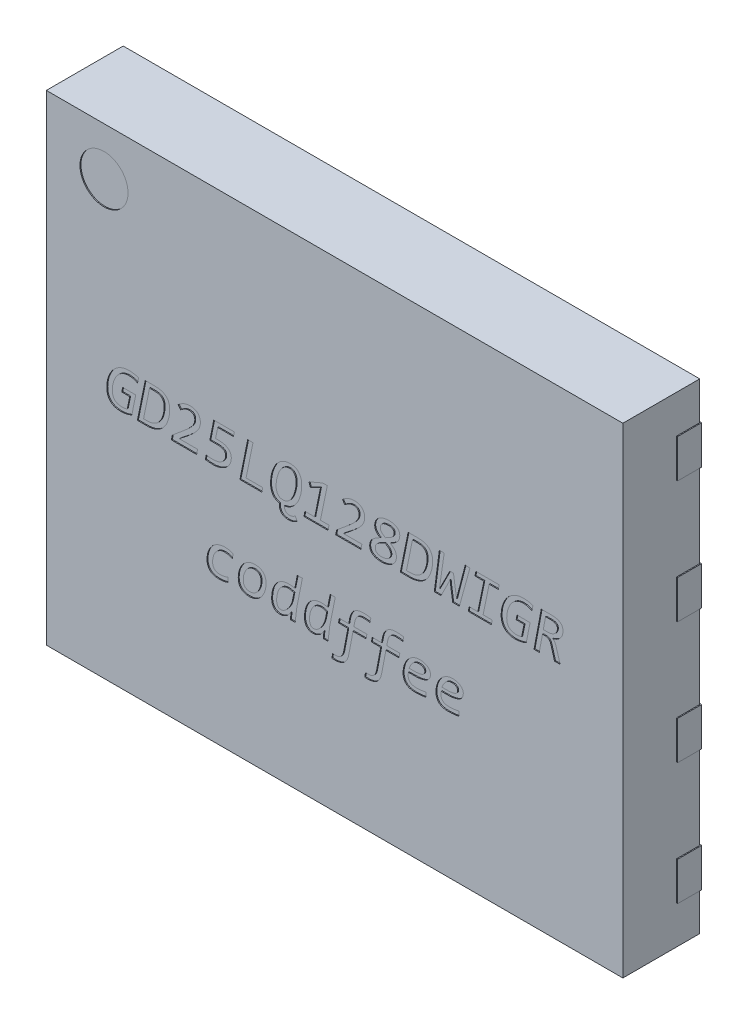
from build123d import *

# Parameters (mm, degrees)
SKETCH_1_W          = 6
SKETCH_1_H          = 5
EXTRUDE_1_DEPTH     = 0.8
SKETCH_2_W          = 0.61
SKETCH_2_H          = 0.4
EXTRUDE_2_DEPTH     = 0.25
EXTRUDE_3_DEPTH     = 0.01
SKETCH_4_R          = 0.25
CUT_EXTRUDE_1_DEPTH = 0.01


with BuildPart() as part:
    # 草图1 → 凸台-拉伸1 (new body)
    with BuildSketch(Plane.XY.offset(0.01)):
        Rectangle(SKETCH_1_W, SKETCH_1_H)
    extrude(amount=EXTRUDE_1_DEPTH)

    # 草图2 → 凸台-拉伸2 (add)
    with BuildSketch(Plane.XY):
        with Locations((-2.705, 0.635)):
            Rectangle(SKETCH_2_W, SKETCH_2_H)
        with Locations((-2.705, 1.905)):
            Rectangle(SKETCH_2_W, SKETCH_2_H)
        with Locations((-2.705, -0.635)):
            Rectangle(SKETCH_2_W, SKETCH_2_H)
        with Locations((-2.705, -1.905)):
            Rectangle(SKETCH_2_W, SKETCH_2_H)
        with Locations((2.705, -1.905)):
            Rectangle(SKETCH_2_W, SKETCH_2_H)
        with Locations((2.705, -0.635)):
            Rectangle(SKETCH_2_W, SKETCH_2_H)
        with Locations((2.705, 0.635)):
            Rectangle(SKETCH_2_W, SKETCH_2_H)
        with Locations((2.705, 1.905)):
            Rectangle(SKETCH_2_W, SKETCH_2_H)
    extrude(amount=EXTRUDE_2_DEPTH)

    # 草图3 → 凸台-拉伸3 (add)
    with BuildSketch(Plane.XY):
        Polygon((-1.2, 2), (-1.7, 1.5), (-1.7, -2), (1.7, -2), (1.7, 2), align=None)
    extrude(amount=EXTRUDE_3_DEPTH)

    # 草图4 → 切除-拉伸1 (cut)
    # profile 1 of 23: a face of its own
    with BuildSketch(Plane.XY.offset(0.81)):
        with Locations((-2.4, 2)):
            Circle(SKETCH_4_R)
    # profile 2 of 23: a face of its own
    with BuildSketch(Plane.XY.offset(0.81)):
        with BuildLine():
            add(Edge.make_bspline(
                [(-2.051177536, 0.336231884), (-2.05442459, 0.337950252), (-2.060883624, 0.341368428), (-2.070784697, 0.345989557), (-2.080913997, 0.35018575), (-2.091530602, 0.353496567), (-2.102636194, 0.356144014), (-2.114291115, 0.358022763), (-2.12666402, 0.359261898), (-2.135171883, 0.359366205), (-2.139583333, 0.35942029)],
                knots=[0, 0, 0, 0, 0.952970316, 1.895647047, 2.833887013, 3.795127737, 4.777427055, 5.793502724, 6.855899164, 8, 8, 8, 8], degree=3))
            add(Edge.make_bspline(
                [(-2.139583333, 0.35942029), (-2.14457018, 0.359293224), (-2.154366089, 0.359043623), (-2.168692368, 0.357241066), (-2.182296487, 0.354121838), (-2.195173734, 0.349907207), (-2.207243636, 0.344447254), (-2.218708644, 0.338368001), (-2.229342794, 0.33120278), (-2.239315793, 0.32333942), (-2.248589888, 0.314679956), (-2.257191094, 0.305331805), (-2.265182019, 0.295344546), (-2.272514655, 0.284737513), (-2.279152174, 0.273622908), (-2.285271872, 0.262184687), (-2.290666876, 0.250387275), (-2.297185023, 0.234411261), (-2.30374848, 0.21393729), (-2.309056293, 0.189099939), (-2.312345203, 0.164640995), (-2.312814524, 0.148529931), (-2.313043478, 0.14067029)],
                knots=[0, 0, 0, 0, 0.962233607, 1.890163092, 2.780623539, 3.65212519, 4.499872717, 5.334097396, 6.153396322, 6.970537776, 7.782678573, 8.599092672, 9.419861231, 10.24898357, 11.085341949, 11.916815253, 12.751039932, 13.587398311, 15.245745347, 16.891413373, 18.483503121, 20, 20, 20, 20], degree=3))
            add(Edge.make_bspline(
                [(-2.313043478, 0.14067029), (-2.312978499, 0.136832876), (-2.312851846, 0.129353282), (-2.311732934, 0.118426242), (-2.309971805, 0.108118316), (-2.307408552, 0.098457446), (-2.304221397, 0.08941177), (-2.300004515, 0.081202875), (-2.295171149, 0.0736104), (-2.289456274, 0.066810516), (-2.282845881, 0.060756331), (-2.275365579, 0.055505148), (-2.267065121, 0.050967902), (-2.257941381, 0.047139337), (-2.247898511, 0.0441313), (-2.236900869, 0.042125505), (-2.225000408, 0.040833611), (-2.216760852, 0.040666254), (-2.2125, 0.04057971)],
                knots=[0, 0, 0, 0, 1.131219409, 2.204886782, 3.235309423, 4.211377383, 5.149221409, 6.05700399, 6.926249827, 7.798272306, 8.667837225, 9.56202836, 10.486422846, 11.452040797, 12.474471205, 13.571001446, 14.743912705, 16, 16, 16, 16], degree=3))
            add(Edge.make_bspline(
                [(-2.2125, 0.04057971), (-2.210446741, 0.040633681), (-2.20606634, 0.040748823), (-2.199231836, 0.041065257), (-2.19198367, 0.041813358), (-2.184618036, 0.042812313), (-2.177365727, 0.043969435), (-2.170428597, 0.045277765), (-2.164085126, 0.046882476), (-2.1601096, 0.048140932), (-2.158242754, 0.048731884)],
                knots=[0, 0, 0, 0, 0.895362332, 1.910156761, 2.981417247, 4.070319436, 5.150035783, 6.182513983, 7.146536122, 8, 8, 8, 8], degree=3))
            Line((-2.158242754, 0.048731884), (-2.132246377, 0.173913043))
            Line((-2.132246377, 0.173913043), (-2.214492754, 0.173913043))
            Line((-2.214492754, 0.173913043), (-2.205887681, 0.220289855))
            Line((-2.205887681, 0.220289855), (-2.069565217, 0.220289855))
            Line((-2.069565217, 0.220289855), (-2.110507246, 0.018115942))
            add(Edge.make_bspline(
                [(-2.110507246, 0.018115942), (-2.115137776, 0.016252176), (-2.124375383, 0.012534084), (-2.138622797, 0.007876036), (-2.153041273, 0.003668804), (-2.167655132, 0.000279969), (-2.182184215, -0.002475136), (-2.196492295, -0.004330558), (-2.210453944, -0.00560453), (-2.219653081, -0.005733545), (-2.224184783, -0.005797101)],
                knots=[0, 0, 0, 0, 1.024683316, 2.044176806, 3.076335296, 4.107972287, 5.123328887, 6.111519474, 7.069692048, 8, 8, 8, 8], degree=3))
            add(Edge.make_bspline(
                [(-2.224184783, -0.005797101), (-2.22977601, -0.005709853), (-2.240684521, -0.00553963), (-2.256567283, -0.003719951), (-2.271617486, -0.001090343), (-2.285739633, 0.002818545), (-2.298952925, 0.007746675), (-2.311059679, 0.013946547), (-2.322144175, 0.02123749), (-2.332138984, 0.029699916), (-2.341109816, 0.039282822), (-2.348906252, 0.050049301), (-2.355658337, 0.061922179), (-2.361250676, 0.074925404), (-2.365752314, 0.08904564), (-2.368718679, 0.104369341), (-2.370687325, 0.120782113), (-2.370903343, 0.132119429), (-2.371014493, 0.137952899)],
                knots=[0, 0, 0, 0, 1.144075349, 2.232096578, 3.268671927, 4.268858223, 5.227402439, 6.150682791, 7.047260215, 7.937594702, 8.825350871, 9.72785295, 10.652435808, 11.615810396, 12.620588878, 13.680038979, 14.806293983, 16, 16, 16, 16], degree=3))
            add(Edge.make_bspline(
                [(-2.371014493, 0.137952899), (-2.37090985, 0.143328835), (-2.370700328, 0.154092902), (-2.36954773, 0.170247603), (-2.367381774, 0.186401371), (-2.364651419, 0.202598129), (-2.36093441, 0.218619132), (-2.356413308, 0.234388871), (-2.350930132, 0.249743042), (-2.344817718, 0.264849884), (-2.337730463, 0.279453789), (-2.329968274, 0.293648295), (-2.32128262, 0.307223922), (-2.31205325, 0.320423199), (-2.301743389, 0.332767928), (-2.290873189, 0.344567262), (-2.278863058, 0.355187854), (-2.266340819, 0.365249613), (-2.252836687, 0.374188952), (-2.238674731, 0.382315518), (-2.223602563, 0.389134775), (-2.207923537, 0.395189779), (-2.191405583, 0.400051187), (-2.174042296, 0.403290891), (-2.155944885, 0.405506318), (-2.143605997, 0.405698949), (-2.137318841, 0.405797101)],
                knots=[0, 0, 0, 0, 0.975866246, 1.953945832, 2.937536976, 3.933100906, 4.934125132, 5.921008437, 6.908971491, 7.892058696, 8.87740398, 9.853624082, 10.826654845, 11.80136632, 12.774597688, 13.743871054, 14.710087576, 15.681512014, 16.657316707, 17.646343149, 18.641891996, 19.656623399, 20.695456459, 21.761639979, 22.85946621, 24, 24, 24, 24], degree=3))
            add(Edge.make_bspline(
                [(-2.137318841, 0.405797101), (-2.128522265, 0.405629474), (-2.111201849, 0.405299415), (-2.089907121, 0.402522075), (-2.073558535, 0.399435124), (-2.061971558, 0.396440773), (-2.050959248, 0.392870905), (-2.044001341, 0.389877727), (-2.04057971, 0.388405797)],
                knots=[0, 0, 0, 0, 1.598842206, 3.148112805, 3.897544911, 4.623293659, 5.322988932, 6, 6, 6, 6], degree=3))
            Line((-2.04057971, 0.388405797), (-2.051177536, 0.336231884))
        make_face()
    # profile 3 of 23: a face of its own
    with BuildSketch(Plane.XY.offset(0.81)):
        with BuildLine():
            Line((-2.052173913, 0), (-1.971014493, 0.4))
            Line((-1.971014493, 0.4), (-1.870923913, 0.4))
            add(Edge.make_bspline(
                [(-1.870923913, 0.4), (-1.864700486, 0.39989755), (-1.852656358, 0.399699279), (-1.83517048, 0.398122142), (-1.818836396, 0.395663359), (-1.803686939, 0.392049803), (-1.789733857, 0.38743634), (-1.776933908, 0.381813542), (-1.765310781, 0.375126884), (-1.754860386, 0.36736621), (-1.745607806, 0.358505656), (-1.737602469, 0.348483416), (-1.730855452, 0.33733573), (-1.725407042, 0.325057427), (-1.721165607, 0.311655653), (-1.71810892, 0.297125769), (-1.716299445, 0.281446585), (-1.716063793, 0.270626875), (-1.715942029, 0.265036232)],
                knots=[0, 0, 0, 0, 1.266390506, 2.450830965, 3.570218992, 4.625447007, 5.616476242, 6.557351712, 7.465886098, 8.339697293, 9.200205639, 10.065832848, 10.942642207, 11.844837127, 12.793187754, 13.798328511, 14.862376156, 16, 16, 16, 16], degree=3))
            add(Edge.make_bspline(
                [(-1.715942029, 0.265036232), (-1.715963109, 0.262862199), (-1.716007332, 0.258301279), (-1.716267969, 0.251079807), (-1.716881841, 0.243146295), (-1.717654851, 0.231309945), (-1.719529364, 0.215397077), (-1.723182692, 0.195312207), (-1.728329148, 0.174015926), (-1.73525919, 0.151885449), (-1.744055408, 0.129374121), (-1.753554832, 0.111105599), (-1.762371241, 0.096910237), (-1.769551255, 0.086345037), (-1.777721155, 0.076244331), (-1.786343643, 0.066261011), (-1.795720608, 0.056711536), (-1.806095311, 0.047903641), (-1.81715845, 0.03958437), (-1.829123346, 0.031935646), (-1.841914639, 0.024955012), (-1.855611455, 0.018676986), (-1.870276994, 0.013315205), (-1.885763246, 0.008417803), (-1.902327362, 0.004626529), (-1.919946413, 0.001947006), (-1.938675881, 0.000287687), (-1.951536291, 9.7724e-05), (-1.958152174, 0)],
                knots=[0, 0, 0, 0, 0.41865694, 0.878303405, 1.391133747, 1.950771014, 3.162355848, 4.473874698, 5.879809938, 7.378511182, 8.936456411, 10.52792214, 11.334661266, 12.153936444, 12.98568066, 13.834542031, 14.693793284, 15.559648155, 16.452697588, 17.357479867, 18.291546626, 19.256795446, 20.255758548, 21.296632, 22.382612311, 23.523958076, 24.72623016, 26, 26, 26, 26], degree=3))
            Line((-1.958152174, 0), (-2.052173913, 0))
        make_face()
        with BuildLine():
            add(Edge.make_bspline(
                [(-1.773913043, 0.262047101), (-1.773956949, 0.266037329), (-1.774041351, 0.273707977), (-1.775395409, 0.284722087), (-1.777280292, 0.294856282), (-1.780218902, 0.304038215), (-1.78386109, 0.31240415), (-1.788268684, 0.319968517), (-1.793621742, 0.326661809), (-1.799736652, 0.332601361), (-1.806688352, 0.33778314), (-1.814446993, 0.3422773), (-1.823119788, 0.345860301), (-1.832570123, 0.348711629), (-1.842765281, 0.351018054), (-1.853772965, 0.352455774), (-1.865558345, 0.353535673), (-1.873698881, 0.353593405), (-1.877898551, 0.353623188)],
                knots=[0, 0, 0, 0, 1.195936167, 2.299018192, 3.323783821, 4.283246164, 5.183438289, 6.056294318, 6.900638664, 7.746002251, 8.606318973, 9.494819497, 10.428287055, 11.413682636, 12.452911399, 13.559445145, 14.740927651, 16, 16, 16, 16], degree=3))
            Line((-1.877898551, 0.353623188), (-1.925815217, 0.353623188))
            Line((-1.925815217, 0.353623188), (-1.988224638, 0.046376812))
            Line((-1.988224638, 0.046376812), (-1.951449275, 0.046376812))
            add(Edge.make_bspline(
                [(-1.951449275, 0.046376812), (-1.946614379, 0.046455365), (-1.937196327, 0.046608382), (-1.923465143, 0.048040155), (-1.910511775, 0.050111471), (-1.898372986, 0.053285018), (-1.886934924, 0.057031288), (-1.876238444, 0.061631937), (-1.866137807, 0.066648901), (-1.856744919, 0.072422524), (-1.848027395, 0.078730258), (-1.839874459, 0.085495146), (-1.832354475, 0.092695435), (-1.823342182, 0.10303244), (-1.813258306, 0.116662939), (-1.803008425, 0.134028864), (-1.794621251, 0.151988026), (-1.788094398, 0.170212701), (-1.782947487, 0.188112546), (-1.779208318, 0.20541468), (-1.776402314, 0.221698711), (-1.774970853, 0.236754002), (-1.774118022, 0.250050259), (-1.77397703, 0.258302127), (-1.773913043, 0.262047101)],
                knots=[0, 0, 0, 0, 1.014326964, 1.975840237, 2.894625532, 3.764475004, 4.606054845, 5.418109951, 6.205896638, 6.970955775, 7.728923434, 8.462338474, 9.192791318, 9.911077642, 11.338073825, 12.744280487, 14.136137725, 15.491160623, 16.802821142, 18.041998205, 19.204542584, 20.268198392, 21.214050243, 22, 22, 22, 22], degree=3))
        make_face(mode=Mode.SUBTRACT)
    # profile 4 of 23: a face of its own
    with BuildSketch(Plane.XY.offset(0.81)):
        with BuildLine():
            Line((-1.436141304, 0), (-1.698550725, 0))
            Line((-1.698550725, 0), (-1.688858696, 0.049184783))
            Line((-1.688858696, 0.049184783), (-1.565217391, 0.152717391))
            add(Edge.make_bspline(
                [(-1.565217391, 0.152717391), (-1.55966392, 0.157395203), (-1.549024172, 0.166357298), (-1.534219995, 0.179711069), (-1.520939056, 0.192005738), (-1.509262966, 0.203468587), (-1.49902571, 0.214229402), (-1.490080729, 0.224372955), (-1.482179978, 0.233850605), (-1.475651042, 0.242993911), (-1.470086206, 0.251591469), (-1.465493497, 0.259766984), (-1.461929625, 0.267591555), (-1.458448244, 0.27742394), (-1.455770412, 0.289562211), (-1.455302534, 0.299291756), (-1.455072464, 0.304076087)],
                knots=[0, 0, 0, 0, 1.580196744, 3.027456869, 4.338630902, 5.518912194, 6.588001302, 7.570299893, 8.462187118, 9.271928696, 10.013820031, 10.690379964, 11.310909882, 11.882464593, 12.958739481, 14, 14, 14, 14], degree=3))
            add(Edge.make_bspline(
                [(-1.455072464, 0.304076087), (-1.455194488, 0.308049272), (-1.455428529, 0.31566981), (-1.458169632, 0.326457042), (-1.462433099, 0.336091927), (-1.468474201, 0.344451039), (-1.476322983, 0.351451389), (-1.486376046, 0.356063918), (-1.498135829, 0.359060279), (-1.506620832, 0.359295157), (-1.511141304, 0.35942029)],
                knots=[0, 0, 0, 0, 1.060694907, 2.034404548, 2.956308187, 3.864376781, 4.774741925, 5.735736457, 6.793690267, 8, 8, 8, 8], degree=3))
            add(Edge.make_bspline(
                [(-1.511141304, 0.35942029), (-1.51528636, 0.359275038), (-1.523537997, 0.358985882), (-1.535764952, 0.356834461), (-1.547719905, 0.353299301), (-1.559294948, 0.348218822), (-1.570591965, 0.342120268), (-1.581664118, 0.335181436), (-1.592587561, 0.327555828), (-1.599439389, 0.321764397), (-1.602898551, 0.31884058)],
                knots=[0, 0, 0, 0, 0.970068288, 1.931132226, 2.89730376, 3.882094903, 4.884611975, 5.900644739, 6.940135448, 8, 8, 8, 8], degree=3))
            Line((-1.602898551, 0.31884058), (-1.628985507, 0.353713768))
            add(Edge.make_bspline(
                [(-1.628985507, 0.353713768), (-1.62438643, 0.357523229), (-1.615295828, 0.365053064), (-1.600898055, 0.375106037), (-1.586114397, 0.384091861), (-1.570640391, 0.391652658), (-1.554456393, 0.397764292), (-1.537504394, 0.402278402), (-1.519766787, 0.40535904), (-1.507621971, 0.405649482), (-1.501449275, 0.405797101)],
                knots=[0, 0, 0, 0, 1.017304364, 2.010818466, 2.98940498, 3.962783469, 4.941369983, 5.932362794, 6.949107502, 8, 8, 8, 8], degree=3))
            add(Edge.make_bspline(
                [(-1.501449275, 0.405797101), (-1.497610684, 0.405709776), (-1.490123303, 0.405539442), (-1.479162042, 0.404218512), (-1.468713293, 0.402201083), (-1.458829099, 0.399154891), (-1.44950116, 0.395486761), (-1.440817909, 0.39104792), (-1.432908587, 0.385761825), (-1.425699415, 0.379730346), (-1.419205185, 0.373052436), (-1.413405681, 0.365745066), (-1.408519338, 0.357728264), (-1.404453749, 0.349094788), (-1.401159146, 0.339913004), (-1.398844822, 0.330192861), (-1.397314846, 0.319945713), (-1.39717379, 0.312928485), (-1.397101449, 0.30932971)],
                knots=[0, 0, 0, 0, 1.150632949, 2.244371938, 3.306095064, 4.337114268, 5.340742127, 6.308449114, 7.255048985, 8.186989588, 9.121696317, 10.043556812, 10.97826354, 11.929914973, 12.90062392, 13.897491886, 14.921731931, 16, 16, 16, 16], degree=3))
            add(Edge.make_bspline(
                [(-1.397101449, 0.30932971), (-1.397187811, 0.305370636), (-1.397359073, 0.297519516), (-1.398743185, 0.285943629), (-1.401022321, 0.274706885), (-1.404200437, 0.263755767), (-1.40842407, 0.252971001), (-1.413714851, 0.242207678), (-1.420213908, 0.231468717), (-1.42764305, 0.220550198), (-1.436283971, 0.209547777), (-1.44593008, 0.198223715), (-1.456893671, 0.186757776), (-1.468878481, 0.174818291), (-1.482222382, 0.162494586), (-1.496817142, 0.149390425), (-1.51294103, 0.135686543), (-1.524232873, 0.126373976), (-1.530072464, 0.121557971)],
                knots=[0, 0, 0, 0, 0.797147957, 1.580800012, 2.344015112, 3.104099035, 3.874210725, 4.673720745, 5.51632717, 6.400097899, 7.331790902, 8.332315444, 9.394763787, 10.525588845, 11.738861841, 13.052300937, 14.475593753, 16, 16, 16, 16], degree=3))
            Line((-1.530072464, 0.121557971), (-1.617210145, 0.052173913))
            Line((-1.617210145, 0.052173913), (-1.426086957, 0.052173913))
            Line((-1.426086957, 0.052173913), (-1.436141304, 0))
        make_face()
    # profile 5 of 23: a face of its own
    with BuildSketch(Plane.XY.offset(0.81)):
        with BuildLine():
            add(Edge.make_bspline(
                [(-1.07509058, 0.148550725), (-1.075259428, 0.143254763), (-1.075593616, 0.132772919), (-1.078429867, 0.117324186), (-1.082952064, 0.102386342), (-1.089330473, 0.088053627), (-1.097359929, 0.074485054), (-1.10667166, 0.061655593), (-1.117499303, 0.049803486), (-1.129604458, 0.038843367), (-1.143070379, 0.029010501), (-1.157626904, 0.020115517), (-1.173500406, 0.012589594), (-1.190372784, 0.005924739), (-1.208325326, 0.000704714), (-1.227104757, -0.003091315), (-1.24671041, -0.005422894), (-1.26004783, -0.005670739), (-1.266847826, -0.005797101)],
                knots=[0, 0, 0, 0, 0.928717278, 1.838130619, 2.746540185, 3.662152379, 4.583571444, 5.508730259, 6.438942558, 7.39553379, 8.369400545, 9.360751507, 10.384464482, 11.448066924, 12.541215522, 13.66031397, 14.807126362, 16, 16, 16, 16], degree=3))
            add(Edge.make_bspline(
                [(-1.266847826, -0.005797101), (-1.27026001, -0.005786386), (-1.27717691, -0.005764666), (-1.287624804, -0.005368913), (-1.298100264, -0.004815693), (-1.308431148, -0.00421052), (-1.318428196, -0.003401067), (-1.327942578, -0.002417878), (-1.336743212, -0.001299792), (-1.342304173, -0.000293537), (-1.344927536, 0.000181159)],
                knots=[0, 0, 0, 0, 1.044502813, 2.117331066, 3.200186155, 4.255875667, 5.285218462, 6.27024057, 7.183992095, 8, 8, 8, 8], degree=3))
            Line((-1.344927536, 0.000181159), (-1.335778986, 0.046376812))
            add(Edge.make_bspline(
                [(-1.335778986, 0.046376812), (-1.333034303, 0.045876639), (-1.327348908, 0.04484057), (-1.318528857, 0.043582627), (-1.309307668, 0.042636604), (-1.299856455, 0.041814229), (-1.290345479, 0.041163535), (-1.280829575, 0.04082425), (-1.271528362, 0.040658079), (-1.265398605, 0.040605399), (-1.26240942, 0.04057971)],
                knots=[0, 0, 0, 0, 0.908406311, 1.881692453, 2.900113492, 3.926429204, 4.970856668, 6.003931323, 7.026614548, 8, 8, 8, 8], degree=3))
            add(Edge.make_bspline(
                [(-1.26240942, 0.04057971), (-1.257756069, 0.040658383), (-1.248606977, 0.040813063), (-1.235213161, 0.042273518), (-1.222442475, 0.044747601), (-1.21030878, 0.048057954), (-1.198861157, 0.052330906), (-1.188214725, 0.057396386), (-1.178303592, 0.06309737), (-1.169354342, 0.069671232), (-1.161154602, 0.076782478), (-1.153978711, 0.08461082), (-1.147761157, 0.09302404), (-1.142495802, 0.101963594), (-1.138321406, 0.111451179), (-1.135180107, 0.12129963), (-1.133469678, 0.131583379), (-1.133198648, 0.138520845), (-1.133061594, 0.142028986)],
                knots=[0, 0, 0, 0, 1.220166707, 2.399005841, 3.528093536, 4.628946758, 5.693896036, 6.728226176, 7.71835301, 8.687741905, 9.636071676, 10.560831783, 11.466786123, 12.375401534, 13.275940511, 14.180128012, 15.079726406, 16, 16, 16, 16], degree=3))
            add(Edge.make_bspline(
                [(-1.133061594, 0.142028986), (-1.133134388, 0.144236919), (-1.133275768, 0.148525172), (-1.134281856, 0.154765957), (-1.135983218, 0.160596296), (-1.138462309, 0.165973072), (-1.141581408, 0.17095062), (-1.145404123, 0.175479475), (-1.149919742, 0.179602411), (-1.155106425, 0.183330138), (-1.161043822, 0.186589898), (-1.167736659, 0.189390422), (-1.175128625, 0.191801105), (-1.183289357, 0.193847727), (-1.192214481, 0.195191267), (-1.201881684, 0.196284129), (-1.212276433, 0.197055045), (-1.21947318, 0.19708565), (-1.223188406, 0.197101449)],
                knots=[0, 0, 0, 0, 0.888619011, 1.725878067, 2.537330492, 3.325977742, 4.101591725, 4.895280693, 5.703906225, 6.557330919, 7.460461648, 8.424439527, 9.47375797, 10.588079712, 11.807001866, 13.103622345, 14.504782878, 16, 16, 16, 16], degree=3))
            Line((-1.223188406, 0.197101449), (-1.298550725, 0.197101449))
            Line((-1.298550725, 0.197101449), (-1.257518116, 0.4))
            Line((-1.257518116, 0.4), (-1.043478261, 0.4))
            Line((-1.043478261, 0.4), (-1.052898551, 0.353623188))
            Line((-1.052898551, 0.353623188), (-1.216576087, 0.353623188))
            Line((-1.216576087, 0.353623188), (-1.238858696, 0.243478261))
            Line((-1.238858696, 0.243478261), (-1.207336957, 0.243478261))
            add(Edge.make_bspline(
                [(-1.207336957, 0.243478261), (-1.202897746, 0.243391372), (-1.194161288, 0.243220372), (-1.181203632, 0.242381918), (-1.168674404, 0.240584124), (-1.156497829, 0.238377126), (-1.144868485, 0.235461756), (-1.133944928, 0.231623453), (-1.123763625, 0.22708625), (-1.114289371, 0.22188888), (-1.105729646, 0.215737621), (-1.097925971, 0.208913295), (-1.091331313, 0.200954892), (-1.0854254, 0.192381902), (-1.080769226, 0.182742156), (-1.077433011, 0.172163181), (-1.075403801, 0.16064516), (-1.075197145, 0.152665537), (-1.07509058, 0.148550725)],
                knots=[0, 0, 0, 0, 1.160525095, 2.283937116, 3.391098912, 4.466848082, 5.51767417, 6.521020575, 7.488982201, 8.428737089, 9.339719699, 10.239558793, 11.129795246, 12.033777585, 12.954991884, 13.915882227, 14.925293447, 16, 16, 16, 16], degree=3))
        make_face()
    # profile 6 of 23: a face of its own
    with BuildSketch(Plane.XY.offset(0.81)):
        Polygon((-0.756974638, 0), (-0.985507246, 0), (-0.904347826, 0.4), (-0.849275362, 0.4), (-0.921286232, 0.046376812), (-0.747826087, 0.046376812), align=None)
    # profile 7 of 23: a face of its own
    with BuildSketch(Plane.XY.offset(0.81)):
        with BuildLine():
            add(Edge.make_bspline(
                [(-0.52173913, -0.005797101), (-0.521800019, -0.009938441), (-0.521916725, -0.017876186), (-0.520157475, -0.029245999), (-0.516539168, -0.039324899), (-0.511033993, -0.048011904), (-0.503448468, -0.054977544), (-0.495681294, -0.059208758), (-0.488584104, -0.06156076), (-0.482530544, -0.062787559), (-0.475959446, -0.06362918), (-0.471379669, -0.063720896), (-0.469021739, -0.063768116)],
                knots=[0, 0, 0, 0, 1.372236972, 2.630179283, 3.793028302, 4.901469333, 6.007056179, 7.172447041, 7.80586777, 8.481582526, 9.218232044, 10, 10, 10, 10], degree=3))
            add(Edge.make_bspline(
                [(-0.469021739, -0.063768116), (-0.464259927, -0.063476086), (-0.454525047, -0.062879069), (-0.44244199, -0.059542215), (-0.432775071, -0.055360545), (-0.425101189, -0.051371601), (-0.417344953, -0.046344718), (-0.41223694, -0.042541822), (-0.409601449, -0.04057971)],
                knots=[0, 0, 0, 0, 1.31922871, 2.696984281, 3.442751908, 4.235938617, 5.089828714, 6, 6, 6, 6], degree=3))
            Line((-0.409601449, -0.04057971), (-0.388405797, -0.078985507))
            add(Edge.make_bspline(
                [(-0.388405797, -0.078985507), (-0.392205444, -0.081635553), (-0.399591104, -0.086786647), (-0.410991108, -0.093446149), (-0.422272836, -0.098919618), (-0.43352651, -0.10307675), (-0.444628705, -0.106317985), (-0.455765854, -0.108440521), (-0.466870399, -0.109883991), (-0.474301098, -0.110058376), (-0.47798913, -0.110144928)],
                knots=[0, 0, 0, 0, 1.151727593, 2.238699765, 3.279861336, 4.265951337, 5.219009151, 6.152671188, 7.083126938, 8, 8, 8, 8], degree=3))
            add(Edge.make_bspline(
                [(-0.47798913, -0.110144928), (-0.481886161, -0.110043193), (-0.489516858, -0.109843988), (-0.50068189, -0.1087204), (-0.511203841, -0.106579992), (-0.521135584, -0.103856348), (-0.530324062, -0.100106393), (-0.538765259, -0.095581897), (-0.546495994, -0.090285075), (-0.553394912, -0.084122916), (-0.559427528, -0.077087178), (-0.564505191, -0.069241319), (-0.568724046, -0.060614286), (-0.571978496, -0.051193633), (-0.574154813, -0.04091255), (-0.575183753, -0.029887603), (-0.575197705, -0.018056969), (-0.574352301, -0.009989056), (-0.573913043, -0.005797101)],
                knots=[0, 0, 0, 0, 1.130315425, 2.213247691, 3.248664475, 4.240866932, 5.195263216, 6.119752588, 7.013506231, 7.906401733, 8.79434683, 9.692890917, 10.60917614, 11.57276528, 12.575649696, 13.648982885, 14.778450221, 16, 16, 16, 16], degree=3))
            add(Edge.make_bspline(
                [(-0.573913043, -0.005797101), (-0.577701598, -0.005043483), (-0.585079698, -0.003575832), (-0.595709888, -0.000380531), (-0.605577155, 0.003673991), (-0.61471251, 0.00859895), (-0.623093481, 0.014335256), (-0.630784495, 0.020891188), (-0.637642516, 0.028363602), (-0.643858616, 0.036565922), (-0.649278793, 0.045528433), (-0.653884042, 0.055239067), (-0.657927319, 0.065563747), (-0.661010249, 0.076664338), (-0.663582278, 0.088359629), (-0.66536534, 0.10074046), (-0.666472883, 0.113808096), (-0.666600984, 0.12276338), (-0.666666667, 0.127355072)],
                knots=[0, 0, 0, 0, 1.035544651, 2.016692944, 2.971593058, 3.891874896, 4.794785597, 5.690660853, 6.596001126, 7.509417228, 8.44681828, 9.399346395, 10.388846453, 11.416605063, 12.485520198, 13.598639652, 14.76873723, 16, 16, 16, 16], degree=3))
            add(Edge.make_bspline(
                [(-0.666666667, 0.127355072), (-0.666586707, 0.132579769), (-0.666425264, 0.143128711), (-0.665428116, 0.15902905), (-0.663660812, 0.175126866), (-0.661337196, 0.191360623), (-0.658325915, 0.207615394), (-0.654314505, 0.223643126), (-0.649998653, 0.239510305), (-0.644680017, 0.255023262), (-0.638699934, 0.270213297), (-0.632146904, 0.285070708), (-0.624746528, 0.299437263), (-0.616722984, 0.313321629), (-0.608114865, 0.326686015), (-0.598559329, 0.339068883), (-0.588381323, 0.350648377), (-0.577496455, 0.361347931), (-0.565950168, 0.371180996), (-0.553510072, 0.379824021), (-0.540385125, 0.38741271), (-0.526557853, 0.394019169), (-0.511946946, 0.399289254), (-0.496564969, 0.403094098), (-0.480445665, 0.40541916), (-0.46945229, 0.405669649), (-0.463858696, 0.405797101)],
                knots=[0, 0, 0, 0, 0.984970863, 1.988709106, 3.001972479, 4.037156874, 5.079825528, 6.116604849, 7.151006519, 8.178794008, 9.206187392, 10.227968075, 11.238590131, 12.251005833, 13.250344674, 14.232829002, 15.196653126, 16.154593587, 17.107855353, 18.05211913, 19.005941512, 19.963273006, 20.937328811, 21.928529578, 22.946004796, 24, 24, 24, 24], degree=3))
            add(Edge.make_bspline(
                [(-0.463858696, 0.405797101), (-0.458933051, 0.405696833), (-0.449385204, 0.405502474), (-0.435545798, 0.403891205), (-0.4226663, 0.401048961), (-0.410699687, 0.397228865), (-0.399690672, 0.392160878), (-0.389591807, 0.386110924), (-0.38041866, 0.378904308), (-0.37235588, 0.370476333), (-0.365201358, 0.361141764), (-0.358973421, 0.350876491), (-0.353768718, 0.339707954), (-0.349363675, 0.327664254), (-0.346045875, 0.314672289), (-0.343747928, 0.300760074), (-0.342243509, 0.285962938), (-0.342101796, 0.275788892), (-0.342028986, 0.270561594)],
                knots=[0, 0, 0, 0, 1.1378936, 2.205687981, 3.212827689, 4.18131667, 5.102203827, 6.006694057, 6.895744508, 7.788727621, 8.694293344, 9.608364228, 10.557052886, 11.536907298, 12.567358647, 13.65002178, 14.792610385, 16, 16, 16, 16], degree=3))
            add(Edge.make_bspline(
                [(-0.342028986, 0.270561594), (-0.342242947, 0.260585846), (-0.34267685, 0.240355578), (-0.345989411, 0.215126364), (-0.34949839, 0.194790982), (-0.352996365, 0.179644825), (-0.356926291, 0.164623227), (-0.361689484, 0.149908494), (-0.366897048, 0.135404808), (-0.372802346, 0.12121759), (-0.379419597, 0.10738548), (-0.38663663, 0.093913862), (-0.394441383, 0.080970956), (-0.403065943, 0.068787228), (-0.412128369, 0.057178314), (-0.421983856, 0.0463912), (-0.432324038, 0.03628992), (-0.44351639, 0.027209905), (-0.455226602, 0.018848471), (-0.467650907, 0.01151816), (-0.480543303, 0.005263384), (-0.493915965, 0.000254025), (-0.507628689, -0.003640814), (-0.517039253, -0.00507889), (-0.52173913, -0.005797101)],
                knots=[0, 0, 0, 0, 1.83756277, 3.726475896, 4.681502038, 5.639877427, 6.590028633, 7.542002736, 8.488939083, 9.429264602, 10.372499342, 11.313483098, 12.244827016, 13.155566332, 14.062780554, 14.956933234, 15.846242815, 16.723953962, 17.610089981, 18.495631876, 19.379073669, 20.247155618, 21.124584542, 22, 22, 22, 22], degree=3))
        make_face()
        with BuildLine():
            add(Edge.make_bspline(
                [(-0.4, 0.267481884), (-0.400057272, 0.270895004), (-0.400168906, 0.277547895), (-0.400889757, 0.287287967), (-0.402123026, 0.296524005), (-0.403987361, 0.305249033), (-0.406131819, 0.31348273), (-0.409111391, 0.32105888), (-0.412500804, 0.328088831), (-0.416621393, 0.334437171), (-0.421224976, 0.340219378), (-0.42652621, 0.34520925), (-0.432360063, 0.349514065), (-0.438801657, 0.353050854), (-0.445776446, 0.356026819), (-0.453542559, 0.357947258), (-0.461940257, 0.35928149), (-0.467808197, 0.359373075), (-0.470833333, 0.35942029)],
                knots=[0, 0, 0, 0, 1.239953505, 2.416931141, 3.546276811, 4.621927318, 5.657105962, 6.632869401, 7.574750486, 8.487567755, 9.376680106, 10.253459638, 11.124456327, 12.003428839, 12.918089652, 13.870577913, 14.902205333, 16, 16, 16, 16], degree=3))
            add(Edge.make_bspline(
                [(-0.470833333, 0.35942029), (-0.474797517, 0.359278326), (-0.482570965, 0.358999945), (-0.493984159, 0.356876664), (-0.504787294, 0.353233671), (-0.514992742, 0.348175454), (-0.524567333, 0.341995449), (-0.533588235, 0.334847242), (-0.542127894, 0.326872406), (-0.550089181, 0.317961165), (-0.557488665, 0.308267808), (-0.564359435, 0.297887597), (-0.57086255, 0.286942247), (-0.578445961, 0.271363975), (-0.586835657, 0.251202468), (-0.594878807, 0.226425608), (-0.601196866, 0.201524187), (-0.604716981, 0.180859313), (-0.606882942, 0.164793142), (-0.607766894, 0.153387558), (-0.608635403, 0.142615409), (-0.608675993, 0.135629721), (-0.608695652, 0.132246377)],
                knots=[0, 0, 0, 0, 0.818660037, 1.605326819, 2.388424359, 3.166737449, 3.952290585, 4.738462609, 5.541648809, 6.363226584, 7.204112906, 8.058745099, 8.933846923, 9.83209633, 11.63574974, 13.440643125, 15.209180266, 16.938191721, 17.768367459, 18.557306136, 19.301267039, 20, 20, 20, 20], degree=3))
            add(Edge.make_bspline(
                [(-0.608695652, 0.132246377), (-0.608637035, 0.128833577), (-0.608522776, 0.122181309), (-0.607820587, 0.1124368), (-0.606521819, 0.103222491), (-0.604899747, 0.094497329), (-0.602461496, 0.086418753), (-0.599740201, 0.078841958), (-0.596237579, 0.07192288), (-0.592263675, 0.065565748), (-0.587743801, 0.059753076), (-0.582447128, 0.054820161), (-0.576646457, 0.050452667), (-0.570205747, 0.046826593), (-0.563047516, 0.043986473), (-0.55521131, 0.042068083), (-0.5467553, 0.040716818), (-0.540887423, 0.04062635), (-0.537862319, 0.04057971)],
                knots=[0, 0, 0, 0, 1.240991074, 2.418953583, 3.549244269, 4.623609536, 5.641522579, 6.614207189, 7.547044299, 8.454735745, 9.337725758, 10.215238963, 11.078140351, 11.972791978, 12.894254582, 13.868796053, 14.90128672, 16, 16, 16, 16], degree=3))
            add(Edge.make_bspline(
                [(-0.537862319, 0.04057971), (-0.533897941, 0.040720734), (-0.526124114, 0.040997271), (-0.514751374, 0.043126889), (-0.503984787, 0.046696012), (-0.493763337, 0.051619097), (-0.484246166, 0.057868832), (-0.475081169, 0.064838332), (-0.466576529, 0.072866929), (-0.458602354, 0.081763055), (-0.45121461, 0.091465298), (-0.444317673, 0.101812364), (-0.437965287, 0.112795756), (-0.430275591, 0.128314205), (-0.421893649, 0.148466066), (-0.413779366, 0.173261901), (-0.407537357, 0.198151175), (-0.403943628, 0.218804706), (-0.401857071, 0.234851147), (-0.400773334, 0.2462405), (-0.400093519, 0.257056737), (-0.400030614, 0.264069121), (-0.4, 0.267481884)],
                knots=[0, 0, 0, 0, 0.81905752, 1.606106252, 2.381690076, 3.157650429, 3.943584974, 4.731227294, 5.534803465, 6.356780139, 7.198074736, 8.053121878, 8.925506857, 9.818606185, 11.631296706, 13.431136303, 15.206585861, 16.930290702, 17.760869514, 18.550758472, 19.294688049, 20, 20, 20, 20], degree=3))
        make_face(mode=Mode.SUBTRACT)
    # profile 8 of 23: a face of its own
    with BuildSketch(Plane.XY.offset(0.81)):
        Polygon((-0.068025362, 0), (-0.31884058, 0), (-0.309057971, 0.052173913), (-0.206431159, 0.052173913), (-0.146557971, 0.347826087), (-0.25317029, 0.295652174), (-0.266666667, 0.338768116), (-0.123369565, 0.4), (-0.075362319, 0.4), (-0.147463768, 0.052173913), (-0.057971014, 0.052173913), align=None)
    # profile 9 of 23: a face of its own
    with BuildSketch(Plane.XY.offset(0.81)):
        with BuildLine():
            Line((0.274003623, 0), (0.011594203, 0))
            Line((0.011594203, 0), (0.021286232, 0.049184783))
            Line((0.021286232, 0.049184783), (0.144927536, 0.152717391))
            add(Edge.make_bspline(
                [(0.144927536, 0.152717391), (0.150481008, 0.157395203), (0.161120756, 0.166357298), (0.175924932, 0.179711069), (0.189205871, 0.192005738), (0.200881961, 0.203468587), (0.211119218, 0.214229402), (0.220064198, 0.224372955), (0.227964949, 0.233850605), (0.234493885, 0.242993911), (0.240058721, 0.251591469), (0.244651431, 0.259766984), (0.248215303, 0.267591555), (0.251696683, 0.27742394), (0.254374515, 0.289562211), (0.254842393, 0.299291756), (0.255072464, 0.304076087)],
                knots=[0, 0, 0, 0, 1.580196744, 3.027456869, 4.338630902, 5.518912194, 6.588001302, 7.570299893, 8.462187118, 9.271928696, 10.013820031, 10.690379964, 11.310909882, 11.882464593, 12.958739481, 14, 14, 14, 14], degree=3))
            add(Edge.make_bspline(
                [(0.255072464, 0.304076087), (0.25495044, 0.308049272), (0.254716399, 0.31566981), (0.251975296, 0.326457042), (0.247711829, 0.336091927), (0.241670726, 0.344451039), (0.233821944, 0.351451389), (0.223768882, 0.356063918), (0.212009099, 0.359060279), (0.203524096, 0.359295157), (0.199003623, 0.35942029)],
                knots=[0, 0, 0, 0, 1.060694907, 2.034404548, 2.956308187, 3.864376781, 4.774741925, 5.735736457, 6.793690267, 8, 8, 8, 8], degree=3))
            add(Edge.make_bspline(
                [(0.199003623, 0.35942029), (0.194858567, 0.359275038), (0.18660693, 0.358985882), (0.174379976, 0.356834461), (0.162425022, 0.353299301), (0.150849979, 0.348218822), (0.139552962, 0.342120268), (0.12848081, 0.335181436), (0.117557367, 0.327555828), (0.110705539, 0.321764397), (0.107246377, 0.31884058)],
                knots=[0, 0, 0, 0, 0.970068288, 1.931132226, 2.89730376, 3.882094903, 4.884611975, 5.900644739, 6.940135448, 8, 8, 8, 8], degree=3))
            Line((0.107246377, 0.31884058), (0.08115942, 0.353713768))
            add(Edge.make_bspline(
                [(0.08115942, 0.353713768), (0.085758497, 0.357523229), (0.094849099, 0.365053064), (0.109246873, 0.375106037), (0.12403053, 0.384091861), (0.139504536, 0.391652658), (0.155688534, 0.397764292), (0.172640534, 0.402278402), (0.19037814, 0.40535904), (0.202522956, 0.405649482), (0.208695652, 0.405797101)],
                knots=[0, 0, 0, 0, 1.017304364, 2.010818466, 2.98940498, 3.962783469, 4.941369983, 5.932362794, 6.949107502, 8, 8, 8, 8], degree=3))
            add(Edge.make_bspline(
                [(0.208695652, 0.405797101), (0.212534244, 0.405709776), (0.220021624, 0.405539442), (0.230982886, 0.404218512), (0.241431635, 0.402201083), (0.251315829, 0.399154891), (0.260643767, 0.395486761), (0.269327018, 0.39104792), (0.277236341, 0.385761825), (0.284445513, 0.379730346), (0.290939743, 0.373052436), (0.296739246, 0.365745066), (0.30162559, 0.357728264), (0.305691179, 0.349094788), (0.308985782, 0.339913004), (0.311300106, 0.330192861), (0.312830082, 0.319945713), (0.312971138, 0.312928485), (0.313043478, 0.30932971)],
                knots=[0, 0, 0, 0, 1.150632949, 2.244371938, 3.306095064, 4.337114268, 5.340742127, 6.308449114, 7.255048985, 8.186989588, 9.121696317, 10.043556812, 10.97826354, 11.929914973, 12.90062392, 13.897491886, 14.921731931, 16, 16, 16, 16], degree=3))
            add(Edge.make_bspline(
                [(0.313043478, 0.30932971), (0.312957116, 0.305370636), (0.312785854, 0.297519516), (0.311401743, 0.285943629), (0.309122607, 0.274706885), (0.305944491, 0.263755767), (0.301720858, 0.252971001), (0.296430077, 0.242207678), (0.289931019, 0.231468717), (0.282501877, 0.220550198), (0.273860957, 0.209547777), (0.264214848, 0.198223715), (0.253251257, 0.186757776), (0.241266447, 0.174818291), (0.227922545, 0.162494586), (0.213327786, 0.149390425), (0.197203898, 0.135686543), (0.185912055, 0.126373976), (0.180072464, 0.121557971)],
                knots=[0, 0, 0, 0, 0.797147957, 1.580800012, 2.344015112, 3.104099035, 3.874210725, 4.673720745, 5.51632717, 6.400097899, 7.331790902, 8.332315444, 9.394763787, 10.525588845, 11.738861841, 13.052300937, 14.475593753, 16, 16, 16, 16], degree=3))
            Line((0.180072464, 0.121557971), (0.092934783, 0.052173913))
            Line((0.092934783, 0.052173913), (0.284057971, 0.052173913))
            Line((0.284057971, 0.052173913), (0.274003623, 0))
        make_face()
    # profile 10 of 23: a face of its own
    with BuildSketch(Plane.XY.offset(0.81)):
        with BuildLine():
            add(Edge.make_bspline(
                [(0.578713768, 0.208695652), (0.583694138, 0.205799123), (0.593323051, 0.200199052), (0.606336745, 0.190566564), (0.617504053, 0.180284022), (0.626867932, 0.169363058), (0.634403223, 0.157639852), (0.639732425, 0.144840784), (0.642845047, 0.130975449), (0.643263818, 0.121392653), (0.643478261, 0.116485507)],
                knots=[0, 0, 0, 0, 1.16302713, 2.248565179, 3.262685119, 4.223144618, 5.146911155, 6.065428976, 7.009347288, 8, 8, 8, 8], degree=3))
            add(Edge.make_bspline(
                [(0.643478261, 0.116485507), (0.643352607, 0.112583853), (0.643100793, 0.104764796), (0.641171128, 0.093138947), (0.637827058, 0.081759461), (0.633430038, 0.070614425), (0.627736064, 0.059861239), (0.620554944, 0.049807667), (0.612330004, 0.040223065), (0.602733147, 0.031452951), (0.591985401, 0.023308456), (0.579910628, 0.016091844), (0.566555641, 0.009786046), (0.552117753, 0.004099362), (0.536304177, -0.000307196), (0.51928463, -0.003559567), (0.500978917, -0.005455751), (0.488380069, -0.005680975), (0.481884058, -0.005797101)],
                knots=[0, 0, 0, 0, 0.827593171, 1.658526668, 2.491827361, 3.339991075, 4.196891407, 5.065965175, 5.956057141, 6.871782887, 7.81859707, 8.812852831, 9.850075368, 10.949301728, 12.101140207, 13.327354751, 14.621974509, 16, 16, 16, 16], degree=3))
            add(Edge.make_bspline(
                [(0.481884058, -0.005797101), (0.477081603, -0.005697283), (0.467793943, -0.00550424), (0.45434067, -0.004390993), (0.441884244, -0.002257585), (0.430342522, 0.000470151), (0.419812589, 0.004117539), (0.410250223, 0.008392695), (0.401576006, 0.013187395), (0.393806303, 0.01859781), (0.387117674, 0.024766268), (0.381093129, 0.031255983), (0.376231094, 0.038529449), (0.372103369, 0.04620377), (0.369022565, 0.054442187), (0.366904115, 0.063051646), (0.365454025, 0.07202293), (0.365297297, 0.078134226), (0.365217391, 0.08125)],
                knots=[0, 0, 0, 0, 1.403882476, 2.715024335, 3.940981093, 5.094673495, 6.177537217, 7.192767505, 8.152797459, 9.070988294, 9.951951262, 10.807984712, 11.652476845, 12.501246545, 13.350291477, 14.215014925, 15.089945652, 16, 16, 16, 16], degree=3))
            add(Edge.make_bspline(
                [(0.365217391, 0.08125), (0.365465211, 0.086854547), (0.365954417, 0.097918142), (0.369125378, 0.111489329), (0.37308933, 0.121885516), (0.377037262, 0.129655473), (0.381933206, 0.137296379), (0.38771832, 0.144898387), (0.394466148, 0.152475341), (0.402358512, 0.159930532), (0.41129555, 0.167383309), (0.421336861, 0.174848739), (0.432636836, 0.182365867), (0.445265635, 0.190072206), (0.459317762, 0.197952909), (0.469275646, 0.203053035), (0.474456522, 0.205706522)],
                knots=[0, 0, 0, 0, 1.340524537, 2.646247884, 3.311810545, 4.000086208, 4.72770418, 5.480605303, 6.284057581, 7.152852228, 8.076123924, 9.0674556, 10.145593656, 11.322827045, 12.607123646, 14, 14, 14, 14], degree=3))
            add(Edge.make_bspline(
                [(0.474456522, 0.205706522), (0.469896891, 0.208359837), (0.461142966, 0.213453874), (0.449429625, 0.222348388), (0.43950737, 0.231727953), (0.43132876, 0.241718949), (0.425100076, 0.252465783), (0.420583726, 0.26393112), (0.4179051, 0.276236069), (0.417565094, 0.284709015), (0.417391304, 0.289039855)],
                knots=[0, 0, 0, 0, 1.187718502, 2.280272025, 3.305159112, 4.258167286, 5.178768493, 6.092127416, 7.024814717, 8, 8, 8, 8], degree=3))
            add(Edge.make_bspline(
                [(0.417391304, 0.289039855), (0.417476869, 0.292702325), (0.417648357, 0.300042579), (0.419642045, 0.310935429), (0.422340566, 0.321790494), (0.426498019, 0.332346279), (0.431604791, 0.342653337), (0.438068899, 0.352322617), (0.445684195, 0.361381071), (0.454423332, 0.369818866), (0.464323027, 0.377668736), (0.475517218, 0.384592787), (0.487823042, 0.390773122), (0.501285941, 0.396148609), (0.515956159, 0.400463663), (0.531826401, 0.403669079), (0.54890334, 0.405426611), (0.560684554, 0.405671086), (0.566757246, 0.405797101)],
                knots=[0, 0, 0, 0, 0.82835749, 1.660178746, 2.501000179, 3.358121958, 4.223494879, 5.10152514, 5.984863977, 6.898768163, 7.848101824, 8.84032123, 9.873874238, 10.963275164, 12.118554487, 13.332114692, 14.624823572, 16, 16, 16, 16], degree=3))
            add(Edge.make_bspline(
                [(0.566757246, 0.405797101), (0.571288197, 0.405729905), (0.580062033, 0.405599784), (0.592809796, 0.40453237), (0.604636491, 0.402628883), (0.615596734, 0.400095132), (0.625666919, 0.396953341), (0.634868861, 0.393161172), (0.643147032, 0.388715301), (0.65054805, 0.383699065), (0.657116618, 0.378179647), (0.662788765, 0.372072219), (0.667536109, 0.365385837), (0.671430788, 0.358198243), (0.674530549, 0.350579952), (0.676705135, 0.342551004), (0.677987496, 0.334159715), (0.678168764, 0.32844647), (0.67826087, 0.325543478)],
                knots=[0, 0, 0, 0, 1.404218958, 2.719161522, 3.960728693, 5.113869416, 6.203037102, 7.226673131, 8.193871375, 9.110108583, 9.993201038, 10.847460707, 11.686202137, 12.527914048, 13.375948864, 14.229541923, 15.100401552, 16, 16, 16, 16], degree=3))
            add(Edge.make_bspline(
                [(0.67826087, 0.325543478), (0.678033692, 0.320151793), (0.677587268, 0.309556632), (0.674643801, 0.296601648), (0.671017257, 0.286741732), (0.667445153, 0.27942161), (0.662965161, 0.272234989), (0.657806322, 0.264970312), (0.651551086, 0.257942203), (0.644489019, 0.25080897), (0.636293891, 0.243873412), (0.627059738, 0.236978017), (0.616776431, 0.229960047), (0.605243035, 0.222917837), (0.592440779, 0.215767599), (0.58340813, 0.211114116), (0.578713768, 0.208695652)],
                knots=[0, 0, 0, 0, 1.389482473, 2.730461661, 3.402937092, 4.09583286, 4.826204519, 5.58462667, 6.390250091, 7.249041127, 8.171169234, 9.155238164, 10.219811244, 11.380141216, 12.638432287, 14, 14, 14, 14], degree=3))
        make_face()
        with BuildLine():
            add(Edge.make_bspline(
                [(0.530072464, 0.232608696), (0.534460615, 0.234823535), (0.54285248, 0.239059176), (0.554693227, 0.245421111), (0.565329361, 0.251276325), (0.574758182, 0.256856437), (0.583146447, 0.262165602), (0.590473615, 0.267460399), (0.597003788, 0.27249549), (0.602514494, 0.277613161), (0.607317252, 0.282549713), (0.611101084, 0.287599609), (0.614283993, 0.292480911), (0.617286196, 0.299117305), (0.61986579, 0.307936325), (0.620145814, 0.315256391), (0.620289855, 0.319021739)],
                knots=[0, 0, 0, 0, 1.564139869, 2.991248565, 4.277247889, 5.427432494, 6.477549114, 7.434764593, 8.303607888, 9.099238584, 9.826488812, 10.49140495, 11.104528983, 11.676280622, 12.804708543, 14, 14, 14, 14], degree=3))
            add(Edge.make_bspline(
                [(0.620289855, 0.319021739), (0.620107258, 0.322036572), (0.619753011, 0.327885498), (0.616731007, 0.336109413), (0.611736882, 0.343245899), (0.604755178, 0.34915883), (0.595977185, 0.353906051), (0.585367904, 0.3571717), (0.573020125, 0.359138941), (0.564199046, 0.359322652), (0.55951087, 0.35942029)],
                knots=[0, 0, 0, 0, 0.879363224, 1.706008061, 2.523980814, 3.400147634, 4.356238525, 5.422726243, 6.630245249, 8, 8, 8, 8], degree=3))
            add(Edge.make_bspline(
                [(0.55951087, 0.35942029), (0.55645904, 0.359372797), (0.550464953, 0.359279518), (0.54169954, 0.35841003), (0.533294729, 0.35721288), (0.525376156, 0.355283742), (0.517926456, 0.352937694), (0.510940399, 0.350151276), (0.504549042, 0.346678031), (0.498600967, 0.342820454), (0.493339207, 0.3383471), (0.48868215, 0.333433445), (0.484645768, 0.328035805), (0.481289854, 0.322137811), (0.478648767, 0.315745566), (0.476751101, 0.308873832), (0.475538265, 0.301552616), (0.475421679, 0.296502441), (0.475362319, 0.293931159)],
                knots=[0, 0, 0, 0, 1.217458127, 2.391204513, 3.512448451, 4.602508703, 5.638979385, 6.627929615, 7.598207543, 8.537235572, 9.452066456, 10.347003848, 11.233793425, 12.134954435, 13.047879088, 13.986288522, 14.97472484, 16, 16, 16, 16], degree=3))
            add(Edge.make_bspline(
                [(0.475362319, 0.293931159), (0.475497743, 0.29108011), (0.475767254, 0.285406179), (0.478070644, 0.277096931), (0.482278725, 0.269329081), (0.48799645, 0.261760592), (0.495725987, 0.254491164), (0.505371146, 0.247280606), (0.516952574, 0.239835969), (0.525511912, 0.235120939), (0.530072464, 0.232608696)],
                knots=[0, 0, 0, 0, 0.789258287, 1.570718488, 2.3640456, 3.22408936, 4.188518442, 5.292878118, 6.557602109, 8, 8, 8, 8], degree=3))
        make_face(mode=Mode.SUBTRACT)
        with BuildLine():
            add(Edge.make_bspline(
                [(0.523550725, 0.181793478), (0.518710381, 0.179609613), (0.509413716, 0.175415146), (0.496253713, 0.16908955), (0.484392425, 0.163146333), (0.473967451, 0.157321986), (0.464668264, 0.151740755), (0.456422291, 0.146280356), (0.449247018, 0.140734566), (0.443038359, 0.135268891), (0.437650772, 0.129867947), (0.433457126, 0.124149832), (0.429787786, 0.118592594), (0.426413204, 0.110793559), (0.423798875, 0.100255759), (0.423397125, 0.091563141), (0.423188406, 0.087047101)],
                knots=[0, 0, 0, 0, 1.515722843, 2.911191449, 4.167735237, 5.302023236, 6.318945302, 7.263144588, 8.123365756, 8.9049547, 9.624182123, 10.294718268, 10.925997816, 11.520181557, 12.711670249, 14, 14, 14, 14], degree=3))
            add(Edge.make_bspline(
                [(0.423188406, 0.087047101), (0.423237621, 0.085141778), (0.423333408, 0.081433505), (0.424157595, 0.076084319), (0.425509079, 0.071076629), (0.427519575, 0.066507056), (0.429967703, 0.06222037), (0.433103386, 0.058451567), (0.436663736, 0.054920705), (0.442369863, 0.050775555), (0.450895414, 0.046531596), (0.462766996, 0.043103721), (0.476430557, 0.040926163), (0.486162312, 0.040699483), (0.491304348, 0.04057971)],
                knots=[0, 0, 0, 0, 0.733793023, 1.428158542, 2.080199921, 2.726402628, 3.34696055, 3.975644849, 4.609154941, 5.274654599, 6.684713661, 8.252630501, 10.019975983, 12, 12, 12, 12], degree=3))
            add(Edge.make_bspline(
                [(0.491304348, 0.04057971), (0.4972378, 0.040815859), (0.509018268, 0.041284716), (0.523445497, 0.044168587), (0.534492888, 0.047482462), (0.542223735, 0.05070429), (0.549603058, 0.054229792), (0.556448235, 0.058358933), (0.562707548, 0.063090204), (0.568382242, 0.068276701), (0.573407219, 0.073992274), (0.577635205, 0.080286015), (0.581282343, 0.08695021), (0.583658105, 0.094232568), (0.585309118, 0.101857799), (0.585440589, 0.107116414), (0.585507246, 0.109782609)],
                knots=[0, 0, 0, 0, 1.916913983, 3.805902963, 4.735034662, 5.641126453, 6.509653565, 7.376589313, 8.219745981, 9.041625869, 9.857749939, 10.672472537, 11.488771622, 12.30349422, 13.139846554, 14, 14, 14, 14], degree=3))
            add(Edge.make_bspline(
                [(0.585507246, 0.109782609), (0.585348935, 0.112939066), (0.585029142, 0.119315217), (0.582414313, 0.128768179), (0.57829454, 0.138172205), (0.571721161, 0.147139023), (0.563325859, 0.156128131), (0.552356138, 0.16479632), (0.539047719, 0.173678092), (0.528953287, 0.178964292), (0.523550725, 0.181793478)],
                knots=[0, 0, 0, 0, 0.754885403, 1.524894363, 2.334045626, 3.200768717, 4.172805262, 5.272847167, 6.540421679, 8, 8, 8, 8], degree=3))
        make_face(mode=Mode.SUBTRACT)
    # profile 11 of 23: a face of its own
    with BuildSketch(Plane.XY.offset(0.81)):
        with BuildLine():
            Line((0.684057971, 0), (0.765217391, 0.4))
            Line((0.765217391, 0.4), (0.865307971, 0.4))
            add(Edge.make_bspline(
                [(0.865307971, 0.4), (0.871531398, 0.39989755), (0.883575526, 0.399699279), (0.901061404, 0.398122142), (0.917395488, 0.395663359), (0.932544945, 0.392049803), (0.946498027, 0.38743634), (0.959297976, 0.381813542), (0.970921103, 0.375126884), (0.981371498, 0.36736621), (0.990624078, 0.358505656), (0.998629415, 0.348483416), (1.005376432, 0.33733573), (1.010824842, 0.325057427), (1.015066277, 0.311655653), (1.018122964, 0.297125769), (1.019932439, 0.281446585), (1.020168091, 0.270626875), (1.020289855, 0.265036232)],
                knots=[0, 0, 0, 0, 1.266390506, 2.450830965, 3.570218992, 4.625447007, 5.616476242, 6.557351712, 7.465886098, 8.339697293, 9.200205639, 10.065832848, 10.942642207, 11.844837127, 12.793187754, 13.798328511, 14.862376156, 16, 16, 16, 16], degree=3))
            add(Edge.make_bspline(
                [(1.020289855, 0.265036232), (1.020268775, 0.262862199), (1.020224552, 0.258301279), (1.019963916, 0.251079807), (1.019350043, 0.243146295), (1.018577033, 0.231309945), (1.01670252, 0.215397077), (1.013049192, 0.195312207), (1.007902736, 0.174015926), (1.000972694, 0.151885449), (0.992176476, 0.129374121), (0.982677052, 0.111105599), (0.973860643, 0.096910237), (0.966680629, 0.086345037), (0.958510729, 0.076244331), (0.949888241, 0.066261011), (0.940511276, 0.056711536), (0.930136573, 0.047903641), (0.919073434, 0.03958437), (0.907108538, 0.031935646), (0.894317245, 0.024955012), (0.880620429, 0.018676986), (0.86595489, 0.013315205), (0.850468638, 0.008417803), (0.833904522, 0.004626529), (0.816285471, 0.001947006), (0.797556003, 0.000287687), (0.784695593, 9.7724e-05), (0.77807971, 0)],
                knots=[0, 0, 0, 0, 0.41865694, 0.878303405, 1.391133747, 1.950771014, 3.162355848, 4.473874698, 5.879809938, 7.378511182, 8.936456411, 10.52792214, 11.334661266, 12.153936444, 12.98568066, 13.834542031, 14.693793284, 15.559648155, 16.452697588, 17.357479867, 18.291546626, 19.256795446, 20.255758548, 21.296632, 22.382612311, 23.523958076, 24.72623016, 26, 26, 26, 26], degree=3))
            Line((0.77807971, 0), (0.684057971, 0))
        make_face()
        with BuildLine():
            add(Edge.make_bspline(
                [(0.962318841, 0.262047101), (0.962274935, 0.266037329), (0.962190533, 0.273707977), (0.960836475, 0.284722087), (0.958951592, 0.294856282), (0.956012982, 0.304038215), (0.952370794, 0.31240415), (0.9479632, 0.319968517), (0.942610142, 0.326661809), (0.936495232, 0.332601361), (0.929543532, 0.33778314), (0.921784891, 0.3422773), (0.913112096, 0.345860301), (0.903661761, 0.348711629), (0.893466603, 0.351018054), (0.882458919, 0.352455774), (0.870673539, 0.353535673), (0.862533003, 0.353593405), (0.858333333, 0.353623188)],
                knots=[0, 0, 0, 0, 1.195936167, 2.299018192, 3.323783821, 4.283246164, 5.183438289, 6.056294318, 6.900638664, 7.746002251, 8.606318973, 9.494819497, 10.428287055, 11.413682636, 12.452911399, 13.559445145, 14.740927651, 16, 16, 16, 16], degree=3))
            Line((0.858333333, 0.353623188), (0.810416667, 0.353623188))
            Line((0.810416667, 0.353623188), (0.748007246, 0.046376812))
            Line((0.748007246, 0.046376812), (0.784782609, 0.046376812))
            add(Edge.make_bspline(
                [(0.784782609, 0.046376812), (0.789617505, 0.046455365), (0.799035557, 0.046608382), (0.812766741, 0.048040155), (0.825720109, 0.050111471), (0.837858899, 0.053285018), (0.84929696, 0.057031288), (0.85999344, 0.061631937), (0.870094077, 0.066648901), (0.879486965, 0.072422524), (0.888204489, 0.078730258), (0.896357425, 0.085495146), (0.903877409, 0.092695435), (0.912889702, 0.10303244), (0.922973578, 0.116662939), (0.933223459, 0.134028864), (0.941610633, 0.151988026), (0.948137486, 0.170212701), (0.953284397, 0.188112546), (0.957023566, 0.20541468), (0.95982957, 0.221698711), (0.961261031, 0.236754002), (0.962113862, 0.250050259), (0.962254854, 0.258302127), (0.962318841, 0.262047101)],
                knots=[0, 0, 0, 0, 1.014326964, 1.975840237, 2.894625532, 3.764475004, 4.606054845, 5.418109951, 6.205896638, 6.970955775, 7.728923434, 8.462338474, 9.192791318, 9.911077642, 11.338073825, 12.744280487, 14.136137725, 15.491160623, 16.802821142, 18.041998205, 19.204542584, 20.268198392, 21.214050243, 22, 22, 22, 22], degree=3))
        make_face(mode=Mode.SUBTRACT)
    # profile 12 of 23: a face of its own
    with BuildSketch(Plane.XY.offset(0.81)):
        Polygon((1.408695652, 0.4), (1.298550725, 0), (1.229166667, 0), (1.207246377, 0.145380435), (1.202898551, 0.191938406), (1.178985507, 0.141576087), (1.107155797, 0), (1.037681159, 0), (1.089855072, 0.4), (1.14057971, 0.4), (1.102083333, 0.13451087), (1.091485507, 0.053623188), (1.122644928, 0.115126812), (1.199456522, 0.266666667), (1.237137681, 0.266666667), (1.261413043, 0.103623188), (1.269836957, 0.053623188), (1.282880435, 0.106793478), (1.35923913, 0.4), align=None)
    # profile 13 of 23: a face of its own
    with BuildSketch(Plane.XY.offset(0.81)):
        Polygon((1.553623188, 0.353623188), (1.460869565, 0.353623188), (1.470471014, 0.4), (1.712952899, 0.4), (1.70317029, 0.353623188), (1.608605072, 0.353623188), (1.545199275, 0.046376812), (1.64057971, 0.046376812), (1.631068841, 0), (1.391304348, 0), (1.400271739, 0.046376812), (1.489855072, 0.046376812), align=None)
    # profile 14 of 23: a face of its own
    with BuildSketch(Plane.XY.offset(0.81)):
        with BuildLine():
            add(Edge.make_bspline(
                [(2.05317029, 0.336231884), (2.049923236, 0.337950252), (2.043464202, 0.341368428), (2.033563129, 0.345989557), (2.023433829, 0.35018575), (2.012817224, 0.353496567), (2.001711632, 0.356144014), (1.990056711, 0.358022763), (1.977683806, 0.359261898), (1.969175943, 0.359366205), (1.964764493, 0.35942029)],
                knots=[0, 0, 0, 0, 0.952970316, 1.895647047, 2.833887013, 3.795127737, 4.777427055, 5.793502724, 6.855899164, 8, 8, 8, 8], degree=3))
            add(Edge.make_bspline(
                [(1.964764493, 0.35942029), (1.959777646, 0.359293224), (1.949981737, 0.359043623), (1.935655458, 0.357241066), (1.922051339, 0.354121838), (1.909174093, 0.349907207), (1.89710419, 0.344447254), (1.885639182, 0.338368001), (1.875005033, 0.33120278), (1.865032033, 0.32333942), (1.855757938, 0.314679956), (1.847156732, 0.305331805), (1.839165807, 0.295344546), (1.831833171, 0.284737513), (1.825195652, 0.273622908), (1.819075954, 0.262184687), (1.81368095, 0.250387275), (1.807162803, 0.234411261), (1.800599346, 0.21393729), (1.795291533, 0.189099939), (1.792002623, 0.164640995), (1.791533302, 0.148529931), (1.791304348, 0.14067029)],
                knots=[0, 0, 0, 0, 0.962233607, 1.890163092, 2.780623539, 3.65212519, 4.499872717, 5.334097396, 6.153396322, 6.970537776, 7.782678573, 8.599092672, 9.419861231, 10.24898357, 11.085341949, 11.916815253, 12.751039932, 13.587398311, 15.245745347, 16.891413373, 18.483503121, 20, 20, 20, 20], degree=3))
            add(Edge.make_bspline(
                [(1.791304348, 0.14067029), (1.791369327, 0.136832876), (1.79149598, 0.129353282), (1.792614892, 0.118426242), (1.794376021, 0.108118316), (1.796939274, 0.098457446), (1.800126429, 0.08941177), (1.804343311, 0.081202875), (1.809176677, 0.0736104), (1.814891552, 0.066810516), (1.821501945, 0.060756331), (1.828982247, 0.055505148), (1.837282705, 0.050967902), (1.846406445, 0.047139337), (1.856449315, 0.0441313), (1.867446957, 0.042125505), (1.879347418, 0.040833611), (1.887586974, 0.040666254), (1.891847826, 0.04057971)],
                knots=[0, 0, 0, 0, 1.131219409, 2.204886782, 3.235309423, 4.211377383, 5.149221409, 6.05700399, 6.926249827, 7.798272306, 8.667837225, 9.56202836, 10.486422846, 11.452040797, 12.474471205, 13.571001446, 14.743912705, 16, 16, 16, 16], degree=3))
            add(Edge.make_bspline(
                [(1.891847826, 0.04057971), (1.893901085, 0.040633681), (1.898281486, 0.040748823), (1.90511599, 0.041065257), (1.912364156, 0.041813358), (1.91972979, 0.042812313), (1.926982099, 0.043969435), (1.93391923, 0.045277765), (1.9402627, 0.046882476), (1.944238226, 0.048140932), (1.946105072, 0.048731884)],
                knots=[0, 0, 0, 0, 0.895362332, 1.910156761, 2.981417247, 4.070319436, 5.150035783, 6.182513983, 7.146536122, 8, 8, 8, 8], degree=3))
            Line((1.946105072, 0.048731884), (1.972101449, 0.173913043))
            Line((1.972101449, 0.173913043), (1.889855072, 0.173913043))
            Line((1.889855072, 0.173913043), (1.898460145, 0.220289855))
            Line((1.898460145, 0.220289855), (2.034782609, 0.220289855))
            Line((2.034782609, 0.220289855), (1.99384058, 0.018115942))
            add(Edge.make_bspline(
                [(1.99384058, 0.018115942), (1.98921005, 0.016252176), (1.979972443, 0.012534084), (1.965725029, 0.007876036), (1.951306553, 0.003668804), (1.936692694, 0.000279969), (1.922163611, -0.002475136), (1.907855531, -0.004330558), (1.893893882, -0.00560453), (1.884694745, -0.005733545), (1.880163043, -0.005797101)],
                knots=[0, 0, 0, 0, 1.024683316, 2.044176806, 3.076335296, 4.107972287, 5.123328887, 6.111519474, 7.069692048, 8, 8, 8, 8], degree=3))
            add(Edge.make_bspline(
                [(1.880163043, -0.005797101), (1.874571816, -0.005709853), (1.863663305, -0.00553963), (1.847780543, -0.003719951), (1.83273034, -0.001090343), (1.818608193, 0.002818545), (1.805394901, 0.007746675), (1.793288147, 0.013946547), (1.782203651, 0.02123749), (1.772208842, 0.029699916), (1.76323801, 0.039282822), (1.755441574, 0.050049301), (1.748689489, 0.061922179), (1.74309715, 0.074925404), (1.738595512, 0.08904564), (1.735629148, 0.104369341), (1.733660501, 0.120782113), (1.733444483, 0.132119429), (1.733333333, 0.137952899)],
                knots=[0, 0, 0, 0, 1.144075349, 2.232096578, 3.268671927, 4.268858223, 5.227402439, 6.150682791, 7.047260215, 7.937594702, 8.825350871, 9.72785295, 10.652435808, 11.615810396, 12.620588878, 13.680038979, 14.806293983, 16, 16, 16, 16], degree=3))
            add(Edge.make_bspline(
                [(1.733333333, 0.137952899), (1.733437976, 0.143328835), (1.733647498, 0.154092902), (1.734800096, 0.170247603), (1.736966052, 0.186401371), (1.739696407, 0.202598129), (1.743413416, 0.218619132), (1.747934518, 0.234388871), (1.753417694, 0.249743042), (1.759530108, 0.264849884), (1.766617363, 0.279453789), (1.774379552, 0.293648295), (1.783065206, 0.307223922), (1.792294577, 0.320423199), (1.802604437, 0.332767928), (1.813474637, 0.344567262), (1.825484768, 0.355187854), (1.838007008, 0.365249613), (1.851511139, 0.374188952), (1.865673095, 0.382315518), (1.880745263, 0.389134775), (1.896424289, 0.395189779), (1.912942243, 0.400051187), (1.93030553, 0.403290891), (1.948402941, 0.405506318), (1.960741829, 0.405698949), (1.967028986, 0.405797101)],
                knots=[0, 0, 0, 0, 0.975866246, 1.953945832, 2.937536976, 3.933100906, 4.934125132, 5.921008437, 6.908971491, 7.892058696, 8.87740398, 9.853624082, 10.826654845, 11.80136632, 12.774597688, 13.743871054, 14.710087576, 15.681512014, 16.657316707, 17.646343149, 18.641891996, 19.656623399, 20.695456459, 21.761639979, 22.85946621, 24, 24, 24, 24], degree=3))
            add(Edge.make_bspline(
                [(1.967028986, 0.405797101), (1.975825561, 0.405629474), (1.993145977, 0.405299415), (2.014440705, 0.402522075), (2.030789291, 0.399435124), (2.042376268, 0.396440773), (2.053388578, 0.392870905), (2.060346485, 0.389877727), (2.063768116, 0.388405797)],
                knots=[0, 0, 0, 0, 1.598842206, 3.148112805, 3.897544911, 4.623293659, 5.322988932, 6, 6, 6, 6], degree=3))
            Line((2.063768116, 0.388405797), (2.05317029, 0.336231884))
        make_face()
    # profile 15 of 23: a face of its own
    with BuildSketch(Plane.XY.offset(0.81)):
        with BuildLine():
            Line((2.347826087, 0), (2.289130435, 0))
            Line((2.289130435, 0), (2.251992754, 0.129076087))
            add(Edge.make_bspline(
                [(2.251992754, 0.129076087), (2.250579023, 0.133653813), (2.247964067, 0.142121162), (2.242489388, 0.153277889), (2.23655804, 0.162408027), (2.229369334, 0.169318712), (2.221144086, 0.174372742), (2.211771569, 0.177599917), (2.201215764, 0.179373422), (2.19378743, 0.179593593), (2.189855072, 0.179710145)],
                knots=[0, 0, 0, 0, 1.301871799, 2.408051719, 3.372126706, 4.249673638, 5.098074908, 5.979154158, 6.930219327, 8, 8, 8, 8], degree=3))
            Line((2.189855072, 0.179710145), (2.163224638, 0.179710145))
            Line((2.163224638, 0.179710145), (2.129710145, 0))
            Line((2.129710145, 0), (2.075362319, 0))
            Line((2.075362319, 0), (2.150724638, 0.4))
            Line((2.150724638, 0.4), (2.257336957, 0.4))
            add(Edge.make_bspline(
                [(2.257336957, 0.4), (2.262260626, 0.399935479), (2.271788592, 0.399810622), (2.285581614, 0.398712232), (2.298387011, 0.396940412), (2.310189929, 0.394406421), (2.321032878, 0.39123721), (2.330914259, 0.387489891), (2.339803621, 0.383015233), (2.347708911, 0.377921574), (2.354769538, 0.372319371), (2.360802438, 0.36601386), (2.365856247, 0.359075648), (2.369802318, 0.351460303), (2.373036075, 0.343410896), (2.375147836, 0.334776283), (2.376577005, 0.325681746), (2.37673215, 0.31942011), (2.376811594, 0.316213768)],
                knots=[0, 0, 0, 0, 1.428775414, 2.764873786, 4.012804054, 5.178099071, 6.265046401, 7.288651419, 8.240944403, 9.147592955, 10.013875543, 10.850579097, 11.672654486, 12.495849996, 13.333883216, 14.184015669, 15.070104566, 16, 16, 16, 16], degree=3))
            add(Edge.make_bspline(
                [(2.376811594, 0.316213768), (2.376734241, 0.312374524), (2.376582001, 0.304818485), (2.375090663, 0.29371624), (2.372646118, 0.283037881), (2.369199515, 0.272830982), (2.364887123, 0.26310946), (2.359957903, 0.253786255), (2.353972674, 0.245113959), (2.347415151, 0.236811427), (2.339910815, 0.229210426), (2.331735771, 0.222121419), (2.322809941, 0.215560918), (2.313130471, 0.209628264), (2.302801049, 0.204239869), (2.291782122, 0.199703398), (2.280305062, 0.195529462), (2.272332042, 0.193445795), (2.268297101, 0.192391304)],
                knots=[0, 0, 0, 0, 1.031720026, 2.030534343, 3.005241897, 3.972995282, 4.921665738, 5.862349523, 6.803453507, 7.75045548, 8.703353512, 9.670119098, 10.657254079, 11.677768324, 12.719751945, 13.785649931, 14.879374547, 16, 16, 16, 16], degree=3))
            add(Edge.make_bspline(
                [(2.268297101, 0.192391304), (2.270825995, 0.191279719), (2.275849523, 0.189071608), (2.28249487, 0.184012597), (2.288164253, 0.177634461), (2.292922519, 0.169986946), (2.297101107, 0.161281235), (2.301202652, 0.151686532), (2.304979616, 0.141050659), (2.307247166, 0.133584641), (2.308423913, 0.129710145)],
                knots=[0, 0, 0, 0, 0.856636413, 1.701668119, 2.572643607, 3.497281282, 4.492452266, 5.573683623, 6.740861098, 8, 8, 8, 8], degree=3))
            Line((2.308423913, 0.129710145), (2.347826087, 0))
        make_face()
        with BuildLine():
            add(Edge.make_bspline(
                [(2.31884058, 0.307608696), (2.31865216, 0.311229917), (2.318292365, 0.318144784), (2.314986393, 0.327799414), (2.309633141, 0.336080406), (2.301818511, 0.342634095), (2.292047558, 0.347704885), (2.280169524, 0.351124693), (2.266292962, 0.353290472), (2.256319828, 0.353507398), (2.250996377, 0.353623188)],
                knots=[0, 0, 0, 0, 0.932575149, 1.780789645, 2.60257395, 3.448312007, 4.383068545, 5.426411457, 6.626271958, 8, 8, 8, 8], degree=3))
            Line((2.250996377, 0.353623188), (2.195652174, 0.353623188))
            Line((2.195652174, 0.353623188), (2.17182971, 0.226086957))
            Line((2.17182971, 0.226086957), (2.213496377, 0.226086957))
            add(Edge.make_bspline(
                [(2.213496377, 0.226086957), (2.217606701, 0.226135931), (2.225636987, 0.226231611), (2.237285318, 0.227570683), (2.248236713, 0.229501051), (2.258411532, 0.232332483), (2.267845367, 0.235837035), (2.276446409, 0.240035507), (2.284348033, 0.244653644), (2.291428274, 0.24990651), (2.297694544, 0.255753799), (2.303263836, 0.261998706), (2.308005363, 0.268745521), (2.31190929, 0.275925402), (2.314978247, 0.283466249), (2.317292011, 0.291249673), (2.318563043, 0.299354405), (2.318747042, 0.304826779), (2.31884058, 0.307608696)],
                knots=[0, 0, 0, 0, 1.323424934, 2.585557574, 3.772234431, 4.902602644, 5.982984854, 7.009663973, 7.982204008, 8.927662755, 9.843073413, 10.738895521, 11.618625301, 12.493502107, 13.365942302, 14.237080185, 15.103808318, 16, 16, 16, 16], degree=3))
        make_face(mode=Mode.SUBTRACT)
    # profile 16 of 23: a face of its own
    with BuildSketch(Plane.XY.offset(0.81)):
        with BuildLine():
            add(Edge.make_bspline(
                [(-1.107246377, -0.988405797), (-1.111431119, -0.989862898), (-1.119631487, -0.992718214), (-1.131840918, -0.996257124), (-1.143551994, -0.999452001), (-1.158628657, -1.002518223), (-1.177408722, -1.005267415), (-1.192500733, -1.005619857), (-1.20009058, -1.005797101)],
                knots=[0, 0, 0, 0, 0.839908974, 1.645875128, 2.409506226, 3.140337848, 4.561861934, 6, 6, 6, 6], degree=3))
            add(Edge.make_bspline(
                [(-1.20009058, -1.005797101), (-1.205046035, -1.005717488), (-1.214704695, -1.005562314), (-1.228709965, -1.004151879), (-1.241880467, -1.00206462), (-1.25412705, -0.998836163), (-1.265591863, -0.994910756), (-1.276162073, -0.990001967), (-1.285834733, -0.984189052), (-1.294585952, -0.977440417), (-1.30243503, -0.96983439), (-1.309167661, -0.961255459), (-1.314837041, -0.951771129), (-1.319543704, -0.941452269), (-1.323183774, -0.930207292), (-1.325662516, -0.918083704), (-1.327231359, -0.905083208), (-1.327432551, -0.896109791), (-1.327536232, -0.891485507)],
                knots=[0, 0, 0, 0, 1.215690106, 2.36949708, 3.451153649, 4.484479016, 5.473336333, 6.421379596, 7.338817531, 8.236903162, 9.127623286, 10.014018602, 10.904769542, 11.833152403, 12.791476214, 13.798514549, 14.865505469, 16, 16, 16, 16], degree=3))
            add(Edge.make_bspline(
                [(-1.327536232, -0.891485507), (-1.327383222, -0.883836349), (-1.327083974, -0.8688765), (-1.324129285, -0.847038423), (-1.319733176, -0.826278248), (-1.313209041, -0.806795174), (-1.305278444, -0.78851669), (-1.295803602, -0.771683784), (-1.285225628, -0.756088342), (-1.273058005, -0.742157935), (-1.25988926, -0.729494361), (-1.245429422, -0.718504542), (-1.230028507, -0.708922189), (-1.213550853, -0.701104721), (-1.196380553, -0.694655253), (-1.178457, -0.690324516), (-1.160056314, -0.687452499), (-1.147595533, -0.68712292), (-1.141304348, -0.686956522)],
                knots=[0, 0, 0, 0, 1.185736364, 2.319005028, 3.412113172, 4.4724488, 5.500001804, 6.497963684, 7.464409164, 8.417326071, 9.36136403, 10.293337708, 11.229068886, 12.169534127, 13.117779137, 14.068449478, 15.024800869, 16, 16, 16, 16], degree=3))
            add(Edge.make_bspline(
                [(-1.141304348, -0.686956522), (-1.133927023, -0.687143794), (-1.119108654, -0.687519956), (-1.100706372, -0.690186585), (-1.086151931, -0.69326796), (-1.07544924, -0.696227911), (-1.065099442, -0.699976486), (-1.058409178, -0.70289316), (-1.055072464, -0.704347826)],
                knots=[0, 0, 0, 0, 1.497558936, 3.008052721, 3.766875002, 4.518129283, 5.260929232, 6, 6, 6, 6], degree=3))
            Line((-1.055072464, -0.704347826), (-1.064492754, -0.750724638))
            add(Edge.make_bspline(
                [(-1.064492754, -0.750724638), (-1.067344042, -0.749415327), (-1.073148017, -0.746750143), (-1.082377456, -0.74344704), (-1.09213052, -0.740438758), (-1.105740063, -0.737158885), (-1.122784345, -0.734053058), (-1.136518966, -0.733569018), (-1.143206522, -0.733333333)],
                knots=[0, 0, 0, 0, 0.695235539, 1.415195007, 2.17106577, 2.956782457, 4.518220033, 6, 6, 6, 6], degree=3))
            add(Edge.make_bspline(
                [(-1.143206522, -0.733333333), (-1.148167049, -0.733491505), (-1.157844454, -0.733800078), (-1.171958456, -0.73616595), (-1.185154965, -0.740274072), (-1.197448703, -0.745897092), (-1.208667285, -0.752977772), (-1.219130804, -0.760954041), (-1.228529674, -0.770177183), (-1.237085308, -0.780320925), (-1.244530469, -0.791419153), (-1.251239953, -0.803149207), (-1.256832618, -0.815693845), (-1.261418593, -0.828887438), (-1.26501001, -0.842522656), (-1.267656672, -0.856379017), (-1.269234262, -0.87043448), (-1.269454387, -0.879857192), (-1.269565217, -0.884601449)],
                knots=[0, 0, 0, 0, 1.082496608, 2.111823749, 3.112434542, 4.091521005, 5.05351085, 6.002659194, 6.958124849, 7.921806453, 8.894304761, 9.871192698, 10.868281046, 11.887536561, 12.917053581, 13.943380192, 14.964509106, 16, 16, 16, 16], degree=3))
            add(Edge.make_bspline(
                [(-1.269565217, -0.884601449), (-1.269533842, -0.887624428), (-1.269472787, -0.89350711), (-1.26840508, -0.902007889), (-1.266933472, -0.909937188), (-1.264714985, -0.917270914), (-1.261955518, -0.924071583), (-1.258480952, -0.930250705), (-1.254465049, -0.935893788), (-1.249737161, -0.940850786), (-1.244415943, -0.945261051), (-1.238474716, -0.94906229), (-1.231974716, -0.952361712), (-1.224807372, -0.954813751), (-1.217178351, -0.956977721), (-1.208914784, -0.958341524), (-1.200083397, -0.959307692), (-1.193994512, -0.959381955), (-1.190851449, -0.95942029)],
                knots=[0, 0, 0, 0, 1.165091352, 2.267254589, 3.299589576, 4.272264836, 5.217359905, 6.124527273, 7.000433721, 7.881896635, 8.758654267, 9.65989703, 10.597355715, 11.562472296, 12.576716248, 13.652728644, 14.788346095, 16, 16, 16, 16], degree=3))
            add(Edge.make_bspline(
                [(-1.190851449, -0.95942029), (-1.184013901, -0.959207543), (-1.169929356, -0.958769309), (-1.148727935, -0.955198845), (-1.127469615, -0.950110098), (-1.113926334, -0.944698266), (-1.107246377, -0.942028986)],
                knots=[0, 0, 0, 0, 0.954314192, 1.965774807, 2.996658311, 4, 4, 4, 4], degree=3))
            Line((-1.107246377, -0.942028986), (-1.107246377, -0.988405797))
        make_face()
    # profile 17 of 23: a face of its own
    with BuildSketch(Plane.XY.offset(0.81)):
        with BuildLine():
            add(Edge.make_bspline(
                [(-0.888134058, -1.005797101), (-0.89251613, -1.005716156), (-0.901090798, -1.005557765), (-0.913560474, -1.004150118), (-0.92530433, -1.00204347), (-0.936276557, -0.998924493), (-0.946526395, -0.994979682), (-0.956032868, -0.990052121), (-0.964747349, -0.984211135), (-0.972788908, -0.977621145), (-0.979901711, -0.970032515), (-0.986085995, -0.961536997), (-0.991381772, -0.952200509), (-0.995516988, -0.941871754), (-0.998892545, -0.930759699), (-1.001175207, -0.918733536), (-1.002692613, -0.905866225), (-1.002828339, -0.896985424), (-1.002898551, -0.892391304)],
                knots=[0, 0, 0, 0, 1.141646598, 2.233929725, 3.266416212, 4.247835534, 5.202032763, 6.124121111, 7.03199869, 7.931689465, 8.827932607, 9.734479312, 10.664623906, 11.617360007, 12.628057728, 13.6866895, 14.803303379, 16, 16, 16, 16], degree=3))
            add(Edge.make_bspline(
                [(-1.002898551, -0.892391304), (-1.002628804, -0.883921741), (-1.002089391, -0.866985146), (-0.998666192, -0.846031019), (-0.994914327, -0.829540871), (-0.991189309, -0.817461093), (-0.987098532, -0.805601806), (-0.982247059, -0.794066786), (-0.976865936, -0.78284488), (-0.9707352, -0.772064315), (-0.964165435, -0.761606693), (-0.956876604, -0.751668369), (-0.94914188, -0.742114002), (-0.940712466, -0.733286504), (-0.931790611, -0.725040957), (-0.922245105, -0.717558083), (-0.912251252, -0.710607961), (-0.901573828, -0.704682776), (-0.890502398, -0.699369161), (-0.878904205, -0.694931741), (-0.866787283, -0.691402128), (-0.854178399, -0.688702996), (-0.841003309, -0.687317255), (-0.832067921, -0.687077909), (-0.827536232, -0.686956522)],
                knots=[0, 0, 0, 0, 1.858857387, 3.717159102, 4.649815244, 5.570520451, 6.49093922, 7.403228976, 8.31643355, 9.221759899, 10.12475318, 11.026431456, 11.926182468, 12.821821206, 13.703887938, 14.591170666, 15.482973885, 16.373494926, 17.269010986, 18.177608077, 19.096425929, 20.037735659, 21.004814226, 22, 22, 22, 22], degree=3))
            add(Edge.make_bspline(
                [(-0.827536232, -0.686956522), (-0.823154555, -0.687039925), (-0.814580659, -0.687203125), (-0.802099875, -0.68857714), (-0.790333142, -0.690812615), (-0.779346201, -0.694017399), (-0.769027351, -0.697934435), (-0.759608492, -0.702952678), (-0.750981465, -0.708779038), (-0.743260398, -0.715534151), (-0.73630786, -0.723108556), (-0.730200057, -0.731575863), (-0.725040459, -0.741001157), (-0.720698639, -0.751254835), (-0.717220796, -0.762380317), (-0.714853359, -0.774407747), (-0.71323257, -0.7872748), (-0.713107651, -0.7961601), (-0.713043478, -0.800724638)],
                knots=[0, 0, 0, 0, 1.143056594, 2.236688751, 3.271920425, 4.264294496, 5.219670211, 6.14655428, 7.042485212, 7.930378231, 8.817012025, 9.72005062, 10.647503729, 11.614759953, 12.621478753, 13.682968704, 14.809699572, 16, 16, 16, 16], degree=3))
            add(Edge.make_bspline(
                [(-0.713043478, -0.800724638), (-0.71326869, -0.809105115), (-0.713720844, -0.825930481), (-0.717273827, -0.846721016), (-0.721056433, -0.863174181), (-0.724718577, -0.875243088), (-0.728866186, -0.887126089), (-0.733774751, -0.898649382), (-0.739183613, -0.909881655), (-0.745184245, -0.920720138), (-0.751818599, -0.931146809), (-0.758996031, -0.941170275), (-0.766846963, -0.950600637), (-0.775122997, -0.959545802), (-0.784184191, -0.967631662), (-0.793530721, -0.975324306), (-0.803574249, -0.982100293), (-0.814098118, -0.988236574), (-0.82524678, -0.993439538), (-0.836879376, -0.997929647), (-0.849027355, -1.001454485), (-0.8616555, -1.004013541), (-0.874755627, -1.005445488), (-0.883631966, -1.005678777), (-0.888134058, -1.005797101)],
                knots=[0, 0, 0, 0, 1.84208112, 3.698320055, 4.626249392, 5.555034008, 6.470905589, 7.393590999, 8.308498809, 9.212273784, 10.116951255, 11.025690995, 11.921991869, 12.814742241, 13.703357251, 14.591252183, 15.475488037, 16.365194469, 17.268383561, 18.178675294, 19.105582014, 20.047313385, 21.009594378, 22, 22, 22, 22], degree=3))
        make_face()
        with BuildLine():
            add(Edge.make_bspline(
                [(-0.765217391, -0.806431159), (-0.765266656, -0.803470253), (-0.765362369, -0.797717758), (-0.766181269, -0.789391078), (-0.767523876, -0.781632259), (-0.76943249, -0.774450436), (-0.771819072, -0.767787104), (-0.774972749, -0.761800388), (-0.778465051, -0.756302384), (-0.78260365, -0.751451789), (-0.787251729, -0.747201731), (-0.792338567, -0.743410025), (-0.798037662, -0.740390172), (-0.804115532, -0.737693373), (-0.810782843, -0.73570896), (-0.817959297, -0.734434426), (-0.825577031, -0.733444599), (-0.830823778, -0.733371051), (-0.833514493, -0.733333333)],
                knots=[0, 0, 0, 0, 1.240615765, 2.410287131, 3.502446362, 4.53678098, 5.521636354, 6.461062037, 7.366555277, 8.246309069, 9.123876229, 10.002081719, 10.896813424, 11.820599536, 12.785334428, 13.802813944, 14.873206279, 16, 16, 16, 16], degree=3))
            add(Edge.make_bspline(
                [(-0.833514493, -0.733333333), (-0.836630376, -0.733379947), (-0.842738728, -0.733471329), (-0.851721701, -0.734878984), (-0.86041325, -0.736743822), (-0.868667169, -0.739751445), (-0.876584756, -0.74326561), (-0.884123736, -0.747459785), (-0.891302511, -0.752243138), (-0.900213148, -0.759552823), (-0.910553026, -0.769874119), (-0.921264859, -0.78399366), (-0.930258208, -0.799518421), (-0.937692093, -0.815946738), (-0.943529146, -0.833150165), (-0.947568407, -0.850823326), (-0.950249709, -0.868487775), (-0.950568457, -0.880214327), (-0.950724638, -0.885960145)],
                knots=[0, 0, 0, 0, 0.701318591, 1.374859408, 2.044954982, 2.701265056, 3.349948515, 3.995591952, 4.642846591, 5.291030321, 6.590001898, 7.924949826, 9.272735746, 10.62470543, 11.982347069, 13.358748851, 14.705830486, 16, 16, 16, 16], degree=3))
            add(Edge.make_bspline(
                [(-0.950724638, -0.885960145), (-0.950675905, -0.88892111), (-0.950581226, -0.894673718), (-0.949752132, -0.903029228), (-0.9484266, -0.910819735), (-0.94652098, -0.918037683), (-0.94407502, -0.924685091), (-0.941109155, -0.930783303), (-0.937529078, -0.936271825), (-0.933459832, -0.94120336), (-0.928773449, -0.945498006), (-0.92358446, -0.949199749), (-0.917959511, -0.952416799), (-0.911780717, -0.954910047), (-0.905182794, -0.957085848), (-0.897978463, -0.958306908), (-0.890366154, -0.959312354), (-0.885118643, -0.959383701), (-0.882427536, -0.95942029)],
                knots=[0, 0, 0, 0, 1.237296598, 2.403838601, 3.505505571, 4.537072909, 5.519293382, 6.461798251, 7.364868917, 8.251926422, 9.127145721, 10.013215261, 10.911689218, 11.828064219, 12.793935007, 13.808692338, 14.876220925, 16, 16, 16, 16], degree=3))
            add(Edge.make_bspline(
                [(-0.882427536, -0.95942029), (-0.879284778, -0.959317976), (-0.873098224, -0.959116571), (-0.864007051, -0.957983799), (-0.855358472, -0.955831367), (-0.847090846, -0.953064093), (-0.839255216, -0.949446137), (-0.831732563, -0.945333004), (-0.824661201, -0.940470505), (-0.815653909, -0.933322138), (-0.805419719, -0.922892697), (-0.794787489, -0.908710738), (-0.785642485, -0.893244693), (-0.77823577, -0.876686392), (-0.772458942, -0.859409274), (-0.768346527, -0.841694422), (-0.765696401, -0.823992708), (-0.765374928, -0.812206797), (-0.765217391, -0.806431159)],
                knots=[0, 0, 0, 0, 0.707243642, 1.392216721, 2.056153913, 2.709160199, 3.350582067, 3.995161195, 4.635719292, 5.2785782, 6.580220427, 7.908859017, 9.257864901, 10.613796069, 11.982074077, 13.349593163, 14.701178851, 16, 16, 16, 16], degree=3))
        make_face(mode=Mode.SUBTRACT)
    # profile 18 of 23: a face of its own
    with BuildSketch(Plane.XY.offset(0.81)):
        with BuildLine():
            add(Edge.make_bspline(
                [(-0.479619565, -0.686956522), (-0.476116634, -0.686962839), (-0.469380415, -0.686974989), (-0.459717739, -0.687372701), (-0.450890935, -0.687863654), (-0.440388414, -0.688963051), (-0.428120787, -0.690818708), (-0.418731383, -0.693333119), (-0.414130435, -0.694565217)],
                knots=[0, 0, 0, 0, 0.952879262, 1.832409507, 2.630706935, 3.35732455, 4.705049526, 6, 6, 6, 6], degree=3))
            Line((-0.414130435, -0.694565217), (-0.388405797, -0.565217391))
            Line((-0.388405797, -0.565217391), (-0.335235507, -0.565217391))
            Line((-0.335235507, -0.565217391), (-0.393478261, -0.857971014))
            add(Edge.make_bspline(
                [(-0.393478261, -0.857971014), (-0.393878083, -0.860234291), (-0.394788278, -0.865386633), (-0.395849398, -0.872275595), (-0.396804727, -0.878886412), (-0.397468186, -0.884910474), (-0.398440646, -0.891748358), (-0.399301309, -0.899487319), (-0.400316232, -0.908120298), (-0.401408419, -0.917751455), (-0.402558565, -0.928446331), (-0.403946533, -0.940245077), (-0.405436684, -0.953251066), (-0.40679079, -0.967612472), (-0.408612981, -0.983323), (-0.409680126, -0.994291558), (-0.410235507, -1)],
                knots=[0, 0, 0, 0, 0.674832782, 1.536254714, 2.046545403, 2.635956164, 3.315547478, 4.074318507, 4.92217534, 5.867929057, 6.920396456, 8.080568018, 9.356256233, 10.76418106, 12.315960681, 14, 14, 14, 14], degree=3))
            Line((-0.410235507, -1), (-0.460235507, -1))
            Line((-0.460235507, -1), (-0.452626812, -0.928804348))
            add(Edge.make_bspline(
                [(-0.452626812, -0.928804348), (-0.456174618, -0.934723765), (-0.46308337, -0.946250827), (-0.475475658, -0.961612817), (-0.488804392, -0.975015387), (-0.503322876, -0.98608478), (-0.518695692, -0.994873769), (-0.534787624, -1.001205802), (-0.551570104, -1.005061333), (-0.562993369, -1.00555056), (-0.56875, -1.005797101)],
                knots=[0, 0, 0, 0, 1.131397534, 2.203205121, 3.229835287, 4.226847727, 5.189950431, 6.12668795, 7.055964661, 8, 8, 8, 8], degree=3))
            add(Edge.make_bspline(
                [(-0.56875, -1.005797101), (-0.572316881, -1.00571479), (-0.579206664, -1.005555798), (-0.589208691, -1.0042004), (-0.598451777, -1.001820047), (-0.607055546, -0.998682806), (-0.614890771, -0.994569557), (-0.622029351, -0.989628468), (-0.628467736, -0.983903992), (-0.634253175, -0.977423074), (-0.639186754, -0.970116468), (-0.64356892, -0.962224106), (-0.647212355, -0.953633507), (-0.650068211, -0.944361991), (-0.652313627, -0.934488101), (-0.653955452, -0.92408056), (-0.654825855, -0.913148856), (-0.654989015, -0.905707899), (-0.655072464, -0.901902174)],
                knots=[0, 0, 0, 0, 1.114413261, 2.152599024, 3.145817099, 4.092261941, 5.008109593, 5.903259949, 6.798907473, 7.694554997, 8.610597055, 9.548157557, 10.512079284, 11.520774242, 12.57597221, 13.674290854, 14.810501189, 16, 16, 16, 16], degree=3))
            add(Edge.make_bspline(
                [(-0.655072464, -0.901902174), (-0.654939484, -0.894619623), (-0.65467678, -0.880232867), (-0.652401395, -0.858993819), (-0.648943935, -0.838391876), (-0.643931835, -0.818569917), (-0.637705692, -0.799634356), (-0.629831111, -0.781918225), (-0.620803307, -0.76534164), (-0.610358346, -0.750056249), (-0.598545582, -0.736125748), (-0.585394815, -0.723656638), (-0.570861915, -0.7128328), (-0.555131725, -0.703504928), (-0.538070277, -0.696019723), (-0.519663226, -0.690804363), (-0.500054609, -0.68755523), (-0.486546886, -0.687159479), (-0.479619565, -0.686956522)],
                knots=[0, 0, 0, 0, 1.122066352, 2.216653982, 3.288432494, 4.339154487, 5.364795967, 6.356519679, 7.322841687, 8.270211146, 9.2044617, 10.132724934, 11.056873547, 11.991402185, 12.945819445, 13.919296721, 14.932929065, 16, 16, 16, 16], degree=3))
        make_face()
        with BuildLine():
            add(Edge.make_bspline(
                [(-0.602898551, -0.895923913), (-0.602789702, -0.900610687), (-0.602582928, -0.909513942), (-0.600708121, -0.922087819), (-0.59758136, -0.933090339), (-0.593231709, -0.942520924), (-0.58725884, -0.950171399), (-0.579514257, -0.955608221), (-0.570174011, -0.958886017), (-0.563434046, -0.959235599), (-0.559873188, -0.95942029)],
                knots=[0, 0, 0, 0, 1.29322691, 2.456685177, 3.498548183, 4.441719091, 5.307346128, 6.144495858, 7.019700473, 8, 8, 8, 8], degree=3))
            add(Edge.make_bspline(
                [(-0.559873188, -0.95942029), (-0.557663348, -0.95935815), (-0.553212263, -0.959232986), (-0.546570947, -0.957961518), (-0.539904781, -0.956085361), (-0.53097632, -0.952334341), (-0.519916156, -0.946010571), (-0.507095294, -0.936342595), (-0.494890968, -0.924447323), (-0.483341505, -0.910750059), (-0.472644438, -0.895590116), (-0.462925087, -0.879258763), (-0.454024557, -0.862141872), (-0.44695049, -0.844244237), (-0.440814753, -0.826592413), (-0.438150958, -0.814702901), (-0.436865942, -0.808967391)],
                knots=[0, 0, 0, 0, 0.449362803, 0.905111708, 1.371998053, 1.857099344, 2.87260121, 3.956832971, 5.11746798, 6.334167092, 7.599571547, 8.889795871, 10.201004841, 11.521587451, 12.804411819, 14, 14, 14, 14], degree=3))
            Line((-0.436865942, -0.808967391), (-0.423369565, -0.74067029))
            add(Edge.make_bspline(
                [(-0.423369565, -0.74067029), (-0.428230447, -0.73876764), (-0.437965305, -0.734957215), (-0.45287109, -0.730951001), (-0.467349932, -0.728146784), (-0.476830454, -0.727733054), (-0.48134058, -0.727536232)],
                knots=[0, 0, 0, 0, 1.047178837, 2.097178493, 3.09477923, 4, 4, 4, 4], degree=3))
            add(Edge.make_bspline(
                [(-0.48134058, -0.727536232), (-0.485421995, -0.727635669), (-0.49334761, -0.727828764), (-0.504869802, -0.729465963), (-0.515556244, -0.732266998), (-0.52545108, -0.736100073), (-0.534506017, -0.740886101), (-0.543004956, -0.746216212), (-0.550805059, -0.752318346), (-0.557958376, -0.759044246), (-0.564526998, -0.766277455), (-0.570289615, -0.774148936), (-0.575615357, -0.782391555), (-0.581664088, -0.794092296), (-0.58797038, -0.809263186), (-0.594095752, -0.827720032), (-0.598261992, -0.846224192), (-0.601048472, -0.864057667), (-0.602462389, -0.880593057), (-0.602760199, -0.891060923), (-0.602898551, -0.895923913)],
                knots=[0, 0, 0, 0, 0.948237405, 1.84136254, 2.697471858, 3.510602768, 4.30150909, 5.074341284, 5.839328887, 6.59889052, 7.354128947, 8.106362348, 8.863586663, 9.632586607, 11.163945054, 12.677320379, 14.146299986, 15.566469154, 16.8694701, 18, 18, 18, 18], degree=3))
        make_face(mode=Mode.SUBTRACT)
    # profile 19 of 23: a face of its own
    with BuildSketch(Plane.XY.offset(0.81)):
        with BuildLine():
            add(Edge.make_bspline(
                [(-0.13759058, -0.686956522), (-0.134087649, -0.686962839), (-0.12735143, -0.686974989), (-0.117688754, -0.687372701), (-0.10886195, -0.687863654), (-0.098359428, -0.688963051), (-0.086091801, -0.690818708), (-0.076702397, -0.693333119), (-0.072101449, -0.694565217)],
                knots=[0, 0, 0, 0, 0.952879262, 1.832409507, 2.630706935, 3.35732455, 4.705049526, 6, 6, 6, 6], degree=3))
            Line((-0.072101449, -0.694565217), (-0.046376812, -0.565217391))
            Line((-0.046376812, -0.565217391), (0.006793478, -0.565217391))
            Line((0.006793478, -0.565217391), (-0.051449275, -0.857971014))
            add(Edge.make_bspline(
                [(-0.051449275, -0.857971014), (-0.051849098, -0.860234291), (-0.052759292, -0.865386633), (-0.053820413, -0.872275595), (-0.054775741, -0.878886412), (-0.055439201, -0.884910474), (-0.056411661, -0.891748358), (-0.057272324, -0.899487319), (-0.058287246, -0.908120298), (-0.059379433, -0.917751455), (-0.06052958, -0.928446331), (-0.061917547, -0.940245077), (-0.063407698, -0.953251066), (-0.064761804, -0.967612472), (-0.066583995, -0.983323), (-0.06765114, -0.994291558), (-0.068206522, -1)],
                knots=[0, 0, 0, 0, 0.674832782, 1.536254714, 2.046545403, 2.635956164, 3.315547478, 4.074318507, 4.92217534, 5.867929057, 6.920396456, 8.080568018, 9.356256233, 10.76418106, 12.315960681, 14, 14, 14, 14], degree=3))
            Line((-0.068206522, -1), (-0.118206522, -1))
            Line((-0.118206522, -1), (-0.110597826, -0.928804348))
            add(Edge.make_bspline(
                [(-0.110597826, -0.928804348), (-0.114145632, -0.934723765), (-0.121054384, -0.946250827), (-0.133446673, -0.961612817), (-0.146775407, -0.975015387), (-0.16129389, -0.98608478), (-0.176666707, -0.994873769), (-0.192758638, -1.001205802), (-0.209541118, -1.005061333), (-0.220964384, -1.00555056), (-0.226721014, -1.005797101)],
                knots=[0, 0, 0, 0, 1.131397534, 2.203205121, 3.229835287, 4.226847727, 5.189950431, 6.12668795, 7.055964661, 8, 8, 8, 8], degree=3))
            add(Edge.make_bspline(
                [(-0.226721014, -1.005797101), (-0.230287896, -1.00571479), (-0.237177679, -1.005555798), (-0.247179706, -1.0042004), (-0.256422791, -1.001820047), (-0.26502656, -0.998682806), (-0.272861786, -0.994569557), (-0.280000366, -0.989628468), (-0.28643875, -0.983903992), (-0.29222419, -0.977423074), (-0.297157768, -0.970116468), (-0.301539934, -0.962224106), (-0.305183369, -0.953633507), (-0.308039226, -0.944361991), (-0.310284641, -0.934488101), (-0.311926467, -0.92408056), (-0.312796869, -0.913148856), (-0.312960029, -0.905707899), (-0.313043478, -0.901902174)],
                knots=[0, 0, 0, 0, 1.114413261, 2.152599024, 3.145817099, 4.092261941, 5.008109593, 5.903259949, 6.798907473, 7.694554997, 8.610597055, 9.548157557, 10.512079284, 11.520774242, 12.57597221, 13.674290854, 14.810501189, 16, 16, 16, 16], degree=3))
            add(Edge.make_bspline(
                [(-0.313043478, -0.901902174), (-0.312910498, -0.894619623), (-0.312647794, -0.880232867), (-0.31037241, -0.858993819), (-0.306914949, -0.838391876), (-0.30190285, -0.818569917), (-0.295676706, -0.799634356), (-0.287802126, -0.781918225), (-0.278774322, -0.76534164), (-0.26832936, -0.750056249), (-0.256516596, -0.736125748), (-0.24336583, -0.723656638), (-0.228832929, -0.7128328), (-0.21310274, -0.703504928), (-0.196041291, -0.696019723), (-0.17763424, -0.690804363), (-0.158025624, -0.68755523), (-0.1445179, -0.687159479), (-0.13759058, -0.686956522)],
                knots=[0, 0, 0, 0, 1.122066352, 2.216653982, 3.288432494, 4.339154487, 5.364795967, 6.356519679, 7.322841687, 8.270211146, 9.2044617, 10.132724934, 11.056873547, 11.991402185, 12.945819445, 13.919296721, 14.932929065, 16, 16, 16, 16], degree=3))
        make_face()
        with BuildLine():
            add(Edge.make_bspline(
                [(-0.260869565, -0.895923913), (-0.260760717, -0.900610687), (-0.260553942, -0.909513942), (-0.258679135, -0.922087819), (-0.255552374, -0.933090339), (-0.251202723, -0.942520924), (-0.245229854, -0.950171399), (-0.237485272, -0.955608221), (-0.228145026, -0.958886017), (-0.22140506, -0.959235599), (-0.217844203, -0.95942029)],
                knots=[0, 0, 0, 0, 1.29322691, 2.456685177, 3.498548183, 4.441719091, 5.307346128, 6.144495858, 7.019700473, 8, 8, 8, 8], degree=3))
            add(Edge.make_bspline(
                [(-0.217844203, -0.95942029), (-0.215634363, -0.95935815), (-0.211183278, -0.959232986), (-0.204541962, -0.957961518), (-0.197875796, -0.956085361), (-0.188947335, -0.952334341), (-0.177887171, -0.946010571), (-0.165066309, -0.936342595), (-0.152861983, -0.924447323), (-0.14131252, -0.910750059), (-0.130615453, -0.895590116), (-0.120896101, -0.879258763), (-0.111995571, -0.862141872), (-0.104921505, -0.844244237), (-0.098785767, -0.826592413), (-0.096121973, -0.814702901), (-0.094836957, -0.808967391)],
                knots=[0, 0, 0, 0, 0.449362803, 0.905111708, 1.371998053, 1.857099344, 2.87260121, 3.956832971, 5.11746798, 6.334167092, 7.599571547, 8.889795871, 10.201004841, 11.521587451, 12.804411819, 14, 14, 14, 14], degree=3))
            Line((-0.094836957, -0.808967391), (-0.08134058, -0.74067029))
            add(Edge.make_bspline(
                [(-0.08134058, -0.74067029), (-0.086201462, -0.73876764), (-0.095936319, -0.734957215), (-0.110842104, -0.730951001), (-0.125320947, -0.728146784), (-0.134801468, -0.727733054), (-0.139311594, -0.727536232)],
                knots=[0, 0, 0, 0, 1.047178837, 2.097178493, 3.09477923, 4, 4, 4, 4], degree=3))
            add(Edge.make_bspline(
                [(-0.139311594, -0.727536232), (-0.143393009, -0.727635669), (-0.151318625, -0.727828764), (-0.162840816, -0.729465963), (-0.173527258, -0.732266998), (-0.183422094, -0.736100073), (-0.192477032, -0.740886101), (-0.200975971, -0.746216212), (-0.208776073, -0.752318346), (-0.215929391, -0.759044246), (-0.222498012, -0.766277455), (-0.22826063, -0.774148936), (-0.233586371, -0.782391555), (-0.239635102, -0.794092296), (-0.245941394, -0.809263186), (-0.252066766, -0.827720032), (-0.256233006, -0.846224192), (-0.259019486, -0.864057667), (-0.260433403, -0.880593057), (-0.260731213, -0.891060923), (-0.260869565, -0.895923913)],
                knots=[0, 0, 0, 0, 0.948237405, 1.84136254, 2.697471858, 3.510602768, 4.30150909, 5.074341284, 5.839328887, 6.59889052, 7.354128947, 8.106362348, 8.863586663, 9.632586607, 11.163945054, 12.677320379, 14.146299986, 15.566469154, 16.8694701, 18, 18, 18, 18], degree=3))
        make_face(mode=Mode.SUBTRACT)
    # profile 20 of 23: a face of its own
    with BuildSketch(Plane.XY.offset(0.81)):
        with BuildLine():
            add(Edge.make_bspline(
                [(0.148731884, -1.00634058), (0.147617022, -1.01178963), (0.145459459, -1.022335039), (0.14130257, -1.037420018), (0.136430745, -1.051193765), (0.130915018, -1.063736825), (0.124568262, -1.075058482), (0.117663218, -1.085488898), (0.109696148, -1.094728645), (0.101059158, -1.103057969), (0.091562443, -1.110368545), (0.081184284, -1.116617716), (0.069981206, -1.12188782), (0.057935812, -1.126154035), (0.044987245, -1.129426908), (0.031064968, -1.131591997), (0.016187458, -1.13312875), (0.005922157, -1.133263776), (0.000634058, -1.133333333)],
                knots=[0, 0, 0, 0, 1.230541562, 2.381435688, 3.459179677, 4.461154228, 5.409265584, 6.328401861, 7.224121817, 8.10306401, 8.979717751, 9.870039045, 10.778624224, 11.714795467, 12.693556841, 13.729354659, 14.830292694, 16, 16, 16, 16], degree=3))
            add(Edge.make_bspline(
                [(0.000634058, -1.133333333), (-0.001630346, -1.133303486), (-0.006582283, -1.133238213), (-0.01419712, -1.133130243), (-0.021801579, -1.132637091), (-0.026721157, -1.132307499), (-0.028985507, -1.132155797)],
                knots=[0, 0, 0, 0, 0.916566605, 2.004403543, 3.081480481, 4, 4, 4, 4], degree=3))
            Line((-0.028985507, -1.132155797), (-0.020289855, -1.086956522))
            add(Edge.make_bspline(
                [(-0.020289855, -1.086956522), (-0.015700483, -1.086956522), (-0.006853865, -1.086956522), (0.001992754, -1.086956522), (0.00625, -1.086956522)],
                knots=[0, 0, 0, 0, 1.037542662, 2, 2, 2, 2], degree=3))
            add(Edge.make_bspline(
                [(0.00625, -1.086956522), (0.009241759, -1.086915272), (0.015088896, -1.086834653), (0.023593697, -1.085890307), (0.031657254, -1.084459336), (0.039255376, -1.082413443), (0.046379093, -1.079630592), (0.053077544, -1.07641557), (0.059312113, -1.072574342), (0.065047575, -1.068105767), (0.070382828, -1.0629631), (0.075258287, -1.057060682), (0.079705415, -1.050408604), (0.083688048, -1.043032626), (0.087221041, -1.034939269), (0.090275253, -1.026081595), (0.093018324, -1.016505102), (0.094398631, -1.009793301), (0.095108696, -1.00634058)],
                knots=[0, 0, 0, 0, 1.079686829, 2.110155707, 3.085163963, 4.034546179, 4.945539966, 5.842600549, 6.713856492, 7.583884064, 8.462744629, 9.383921057, 10.342334831, 11.347172967, 12.406415223, 13.526879592, 14.727763661, 16, 16, 16, 16], degree=3))
            Line((0.095108696, -1.00634058), (0.138043478, -0.779710145))
            Line((0.138043478, -0.779710145), (0.04057971, -0.779710145))
            Line((0.04057971, -0.779710145), (0.049365942, -0.733333333))
            Line((0.049365942, -0.733333333), (0.14692029, -0.733333333))
            Line((0.14692029, -0.733333333), (0.155706522, -0.687137681))
            add(Edge.make_bspline(
                [(0.155706522, -0.687137681), (0.156788201, -0.681868548), (0.158898512, -0.671588696), (0.163070873, -0.65685064), (0.167930094, -0.64313382), (0.173713746, -0.630580696), (0.179844199, -0.618877729), (0.187014177, -0.608413286), (0.194784172, -0.59893127), (0.203381585, -0.590520931), (0.212777383, -0.583112863), (0.223065359, -0.576766594), (0.234221897, -0.571415229), (0.246205095, -0.566928578), (0.259159873, -0.563642863), (0.272966084, -0.561224917), (0.287643413, -0.559614881), (0.297731107, -0.559486204), (0.302898551, -0.55942029)],
                knots=[0, 0, 0, 0, 1.194450244, 2.330320955, 3.399511415, 4.423007577, 5.398233684, 6.330159548, 7.235225641, 8.117339257, 8.996132324, 9.887603815, 10.796463712, 11.740759542, 12.724892428, 13.760251112, 14.852683714, 16, 16, 16, 16], degree=3))
            add(Edge.make_bspline(
                [(0.302898551, -0.55942029), (0.308547129, -0.559516107), (0.320402337, -0.559717206), (0.338713319, -0.561157392), (0.357744131, -0.563277503), (0.370481133, -0.565541453), (0.376811594, -0.566666667)],
                knots=[0, 0, 0, 0, 0.911446406, 1.912938903, 2.962702695, 4, 4, 4, 4], degree=3))
            Line((0.376811594, -0.566666667), (0.367300725, -0.611594203))
            add(Edge.make_bspline(
                [(0.367300725, -0.611594203), (0.361509571, -0.610731498), (0.349893242, -0.60900102), (0.332391753, -0.607268144), (0.31487425, -0.60597458), (0.303202891, -0.605856221), (0.297373188, -0.605797101)],
                knots=[0, 0, 0, 0, 1.00020693, 2.006289874, 3.004166046, 4, 4, 4, 4], degree=3))
            add(Edge.make_bspline(
                [(0.297373188, -0.605797101), (0.294412141, -0.60584012), (0.288656272, -0.605923741), (0.280228776, -0.606839379), (0.272292635, -0.60843209), (0.264710345, -0.610304618), (0.257703414, -0.613140925), (0.251051713, -0.616313546), (0.244968228, -0.620319939), (0.239175142, -0.624698711), (0.234000324, -0.629983764), (0.229170335, -0.635869705), (0.224811932, -0.642571703), (0.220839237, -0.649993166), (0.217295728, -0.658203776), (0.214247729, -0.667177455), (0.211627627, -0.676898676), (0.210230366, -0.683657394), (0.20951087, -0.687137681)],
                knots=[0, 0, 0, 0, 1.070260168, 2.0804389, 3.058799095, 3.996106414, 4.898172692, 5.786663282, 6.655695763, 7.526919315, 8.406852598, 9.322358342, 10.276048987, 11.291873848, 12.362579262, 13.505209524, 14.715350128, 16, 16, 16, 16], degree=3))
            Line((0.20951087, -0.687137681), (0.200634058, -0.733333333))
            Line((0.200634058, -0.733333333), (0.336231884, -0.733333333))
            Line((0.336231884, -0.733333333), (0.327264493, -0.779710145))
            Line((0.327264493, -0.779710145), (0.191757246, -0.779710145))
            Line((0.191757246, -0.779710145), (0.148731884, -1.00634058))
        make_face()
    # profile 21 of 23: a face of its own
    with BuildSketch(Plane.XY.offset(0.81)):
        with BuildLine():
            add(Edge.make_bspline(
                [(0.49076087, -1.00634058), (0.489646008, -1.01178963), (0.487488445, -1.022335039), (0.483331556, -1.037420018), (0.478459731, -1.051193765), (0.472944004, -1.063736825), (0.466597247, -1.075058482), (0.459692204, -1.085488898), (0.451725133, -1.094728645), (0.443088144, -1.103057969), (0.433591428, -1.110368545), (0.42321327, -1.116617716), (0.412010191, -1.12188782), (0.399964797, -1.126154035), (0.387016231, -1.129426908), (0.373093954, -1.131591997), (0.358216444, -1.13312875), (0.347951143, -1.133263776), (0.342663043, -1.133333333)],
                knots=[0, 0, 0, 0, 1.230541562, 2.381435688, 3.459179677, 4.461154228, 5.409265584, 6.328401861, 7.224121817, 8.10306401, 8.979717751, 9.870039045, 10.778624224, 11.714795467, 12.693556841, 13.729354659, 14.830292694, 16, 16, 16, 16], degree=3))
            add(Edge.make_bspline(
                [(0.342663043, -1.133333333), (0.340398639, -1.133303486), (0.335446702, -1.133238213), (0.327831866, -1.133130243), (0.320227406, -1.132637091), (0.315307828, -1.132307499), (0.313043478, -1.132155797)],
                knots=[0, 0, 0, 0, 0.916566605, 2.004403543, 3.081480481, 4, 4, 4, 4], degree=3))
            Line((0.313043478, -1.132155797), (0.32173913, -1.086956522))
            add(Edge.make_bspline(
                [(0.32173913, -1.086956522), (0.326328502, -1.086956522), (0.335175121, -1.086956522), (0.344021739, -1.086956522), (0.348278986, -1.086956522)],
                knots=[0, 0, 0, 0, 1.037542662, 2, 2, 2, 2], degree=3))
            add(Edge.make_bspline(
                [(0.348278986, -1.086956522), (0.351270744, -1.086915272), (0.357117881, -1.086834653), (0.365622683, -1.085890307), (0.373686239, -1.084459336), (0.381284362, -1.082413443), (0.388408078, -1.079630592), (0.39510653, -1.07641557), (0.401341098, -1.072574342), (0.40707656, -1.068105767), (0.412411814, -1.0629631), (0.417287272, -1.057060682), (0.421734401, -1.050408604), (0.425717034, -1.043032626), (0.429250027, -1.034939269), (0.432304239, -1.026081595), (0.43504731, -1.016505102), (0.436427616, -1.009793301), (0.437137681, -1.00634058)],
                knots=[0, 0, 0, 0, 1.079686829, 2.110155707, 3.085163963, 4.034546179, 4.945539966, 5.842600549, 6.713856492, 7.583884064, 8.462744629, 9.383921057, 10.342334831, 11.347172967, 12.406415223, 13.526879592, 14.727763661, 16, 16, 16, 16], degree=3))
            Line((0.437137681, -1.00634058), (0.480072464, -0.779710145))
            Line((0.480072464, -0.779710145), (0.382608696, -0.779710145))
            Line((0.382608696, -0.779710145), (0.391394928, -0.733333333))
            Line((0.391394928, -0.733333333), (0.488949275, -0.733333333))
            Line((0.488949275, -0.733333333), (0.497735507, -0.687137681))
            add(Edge.make_bspline(
                [(0.497735507, -0.687137681), (0.498817187, -0.681868548), (0.500927497, -0.671588696), (0.505099859, -0.65685064), (0.50995908, -0.64313382), (0.515742731, -0.630580696), (0.521873185, -0.618877729), (0.529043162, -0.608413286), (0.536813157, -0.59893127), (0.54541057, -0.590520931), (0.554806368, -0.583112863), (0.565094345, -0.576766594), (0.576250882, -0.571415229), (0.588234081, -0.566928578), (0.601188859, -0.563642863), (0.614995069, -0.561224917), (0.629672399, -0.559614881), (0.639760093, -0.559486204), (0.644927536, -0.55942029)],
                knots=[0, 0, 0, 0, 1.194450244, 2.330320955, 3.399511415, 4.423007577, 5.398233684, 6.330159548, 7.235225641, 8.117339257, 8.996132324, 9.887603815, 10.796463712, 11.740759542, 12.724892428, 13.760251112, 14.852683714, 16, 16, 16, 16], degree=3))
            add(Edge.make_bspline(
                [(0.644927536, -0.55942029), (0.650576115, -0.559516107), (0.662431322, -0.559717206), (0.680742304, -0.561157392), (0.699773116, -0.563277503), (0.712510119, -0.565541453), (0.71884058, -0.566666667)],
                knots=[0, 0, 0, 0, 0.911446406, 1.912938903, 2.962702695, 4, 4, 4, 4], degree=3))
            Line((0.71884058, -0.566666667), (0.70932971, -0.611594203))
            add(Edge.make_bspline(
                [(0.70932971, -0.611594203), (0.703538556, -0.610731498), (0.691922227, -0.60900102), (0.674420739, -0.607268144), (0.656903236, -0.60597458), (0.645231876, -0.605856221), (0.639402174, -0.605797101)],
                knots=[0, 0, 0, 0, 1.00020693, 2.006289874, 3.004166046, 4, 4, 4, 4], degree=3))
            add(Edge.make_bspline(
                [(0.639402174, -0.605797101), (0.636441127, -0.60584012), (0.630685258, -0.605923741), (0.622257762, -0.606839379), (0.61432162, -0.60843209), (0.606739331, -0.610304618), (0.599732399, -0.613140925), (0.593080699, -0.616313546), (0.586997213, -0.620319939), (0.581204127, -0.624698711), (0.576029309, -0.629983764), (0.571199321, -0.635869705), (0.566840917, -0.642571703), (0.562868223, -0.649993166), (0.559324714, -0.658203776), (0.556276714, -0.667177455), (0.553656613, -0.676898676), (0.552259351, -0.683657394), (0.551539855, -0.687137681)],
                knots=[0, 0, 0, 0, 1.070260168, 2.0804389, 3.058799095, 3.996106414, 4.898172692, 5.786663282, 6.655695763, 7.526919315, 8.406852598, 9.322358342, 10.276048987, 11.291873848, 12.362579262, 13.505209524, 14.715350128, 16, 16, 16, 16], degree=3))
            Line((0.551539855, -0.687137681), (0.542663043, -0.733333333))
            Line((0.542663043, -0.733333333), (0.67826087, -0.733333333))
            Line((0.67826087, -0.733333333), (0.669293478, -0.779710145))
            Line((0.669293478, -0.779710145), (0.533786232, -0.779710145))
            Line((0.533786232, -0.779710145), (0.49076087, -1.00634058))
        make_face()
    # profile 22 of 23: a face of its own
    with BuildSketch(Plane.XY.offset(0.81)):
        with BuildLine():
            add(Edge.make_bspline(
                [(0.768297101, -0.860869565), (0.767825746, -0.863493269), (0.766912664, -0.868575763), (0.76588472, -0.876034177), (0.765327893, -0.883203745), (0.765254034, -0.887891632), (0.765217391, -0.890217391)],
                knots=[0, 0, 0, 0, 1.08232327, 2.096616488, 3.055691347, 4, 4, 4, 4], degree=3))
            add(Edge.make_bspline(
                [(0.765217391, -0.890217391), (0.765247096, -0.892939126), (0.765304747, -0.898221412), (0.766394989, -0.905874339), (0.767849224, -0.913095971), (0.770153804, -0.919783232), (0.772969842, -0.926020074), (0.776393489, -0.931795602), (0.780643307, -0.936934995), (0.785351305, -0.941743178), (0.790844022, -0.945887724), (0.796969129, -0.949554375), (0.803817966, -0.952614488), (0.811360088, -0.955177373), (0.819637586, -0.956985738), (0.828545638, -0.958495248), (0.838150685, -0.95926516), (0.844775488, -0.959367544), (0.848188406, -0.95942029)],
                knots=[0, 0, 0, 0, 1.055944961, 2.049356281, 2.996932652, 3.912853921, 4.789187031, 5.651920497, 6.510820284, 7.373155204, 8.25970624, 9.174726308, 10.14034242, 11.167507463, 12.262637455, 13.42702108, 14.674471489, 16, 16, 16, 16], degree=3))
            add(Edge.make_bspline(
                [(0.848188406, -0.95942029), (0.857282341, -0.95923469), (0.875444306, -0.958864019), (0.897940252, -0.956672369), (0.915450568, -0.954252121), (0.927852951, -0.952232805), (0.939556956, -0.950206089), (0.947075699, -0.948603731), (0.950724638, -0.947826087)],
                knots=[0, 0, 0, 0, 1.583428581, 3.162346657, 3.931925035, 4.661452502, 5.350386456, 6, 6, 6, 6], degree=3))
            Line((0.950724638, -0.947826087), (0.950724638, -0.994202899))
            add(Edge.make_bspline(
                [(0.950724638, -0.994202899), (0.946773543, -0.995039356), (0.93862141, -0.996765184), (0.925995615, -0.999003192), (0.912645342, -1.000997405), (0.893887404, -1.003288272), (0.869757979, -1.005313826), (0.850276318, -1.005635499), (0.84048913, -1.005797101)],
                knots=[0, 0, 0, 0, 0.654614253, 1.350638792, 2.078096303, 2.842372918, 4.413672753, 6, 6, 6, 6], degree=3))
            add(Edge.make_bspline(
                [(0.84048913, -1.005797101), (0.835232304, -1.005716804), (0.825062284, -1.005561457), (0.810322421, -1.00418138), (0.796627539, -1.001963911), (0.78398006, -0.998812533), (0.772404173, -0.99475623), (0.761895434, -0.989745353), (0.752406517, -0.983866648), (0.744019132, -0.977031582), (0.736676815, -0.969313441), (0.730350669, -0.960781502), (0.724916084, -0.951444718), (0.720636097, -0.941246518), (0.717143484, -0.930314809), (0.714740614, -0.918564913), (0.713263102, -0.906016422), (0.713118066, -0.897377493), (0.713043478, -0.892934783)],
                knots=[0, 0, 0, 0, 1.293447622, 2.502344158, 3.639629483, 4.704713845, 5.705880857, 6.653092546, 7.564386988, 8.446370468, 9.308313088, 10.179177427, 11.054752337, 11.960181222, 12.895485203, 13.874795397, 14.90707898, 16, 16, 16, 16], degree=3))
            add(Edge.make_bspline(
                [(0.713043478, -0.892934783), (0.713198, -0.885983424), (0.713503319, -0.872248242), (0.716000077, -0.851934467), (0.720181654, -0.832283219), (0.725871491, -0.813300993), (0.733097271, -0.79525317), (0.741662252, -0.778252982), (0.751314676, -0.762333649), (0.76232261, -0.747672172), (0.774554965, -0.734395366), (0.78780707, -0.722373063), (0.80234331, -0.712100297), (0.817692695, -0.703011635), (0.834094161, -0.695884305), (0.851252234, -0.69066986), (0.869145132, -0.687490314), (0.881327638, -0.687136025), (0.8875, -0.686956522)],
                knots=[0, 0, 0, 0, 1.11215868, 2.197513393, 3.269307335, 4.324029646, 5.36482578, 6.376099036, 7.367190148, 8.340310063, 9.304657743, 10.252437179, 11.19775017, 12.148284428, 13.102507952, 14.051714991, 15.012886038, 16, 16, 16, 16], degree=3))
            add(Edge.make_bspline(
                [(0.8875, -0.686956522), (0.891730244, -0.687013278), (0.899966665, -0.687123786), (0.91194865, -0.688349072), (0.923216628, -0.690211814), (0.933747296, -0.692852159), (0.943567399, -0.696100715), (0.952611385, -0.699959007), (0.960840378, -0.70444803), (0.968307721, -0.709405178), (0.974932763, -0.71495874), (0.980809983, -0.720962386), (0.985773038, -0.727485142), (0.989932224, -0.734424093), (0.993026596, -0.741773292), (0.995497463, -0.749383144), (0.996830544, -0.757350233), (0.997010856, -0.762767413), (0.997101449, -0.76548913)],
                knots=[0, 0, 0, 0, 1.347874163, 2.624354336, 3.834690972, 4.98540281, 6.080989185, 7.128563814, 8.114751219, 9.064971197, 9.98049241, 10.865249123, 11.737194441, 12.587195097, 13.436378157, 14.273422736, 15.132527318, 16, 16, 16, 16], degree=3))
            add(Edge.make_bspline(
                [(0.997101449, -0.76548913), (0.997020384, -0.769031409), (0.996861274, -0.775983944), (0.994911738, -0.78611881), (0.992110333, -0.795788828), (0.987848223, -0.804855459), (0.98239331, -0.813374882), (0.975468434, -0.821210768), (0.967252583, -0.828515772), (0.957585714, -0.835101169), (0.946510588, -0.841036783), (0.933935107, -0.846113358), (0.919944919, -0.850691479), (0.904384432, -0.854310397), (0.887281652, -0.857350422), (0.868486079, -0.85933369), (0.847995076, -0.860619701), (0.833758216, -0.860784113), (0.826358696, -0.860869565)],
                knots=[0, 0, 0, 0, 0.774957272, 1.52103179, 2.253462957, 2.975575769, 3.707678284, 4.462498895, 5.259035213, 6.110403171, 7.018979664, 8.006635966, 9.077673758, 10.24087637, 11.503485857, 12.881191202, 14.379018393, 16, 16, 16, 16], degree=3))
            Line((0.826358696, -0.860869565), (0.768297101, -0.860869565))
        make_face()
        with BuildLine():
            add(Edge.make_bspline(
                [(0.82490942, -0.820289855), (0.830284563, -0.820233175), (0.840587111, -0.820124537), (0.855306318, -0.819434986), (0.868582708, -0.81820439), (0.880435663, -0.816395758), (0.89098603, -0.814130666), (0.900348641, -0.811538038), (0.90856927, -0.808562048), (0.915664817, -0.805221111), (0.921757495, -0.801573002), (0.926826188, -0.797634252), (0.930933733, -0.793397458), (0.934959175, -0.787541008), (0.938383555, -0.779658516), (0.938884291, -0.773013054), (0.939130435, -0.769746377)],
                knots=[0, 0, 0, 0, 1.64133148, 3.145943989, 4.498187849, 5.710844004, 6.804879399, 7.791425461, 8.675214781, 9.471154513, 10.182682469, 10.839287561, 11.426167604, 11.976033211, 13.005088685, 14, 14, 14, 14], degree=3))
            add(Edge.make_bspline(
                [(0.939130435, -0.769746377), (0.938988538, -0.766946385), (0.938707807, -0.761406855), (0.935986483, -0.753450047), (0.931763868, -0.74600881), (0.925242869, -0.73972921), (0.917044286, -0.734385118), (0.906935983, -0.730494943), (0.895027926, -0.727871383), (0.88645958, -0.727652902), (0.881884058, -0.727536232)],
                knots=[0, 0, 0, 0, 0.839188636, 1.660258689, 2.502584123, 3.388449339, 4.35284299, 5.428379705, 6.626747016, 8, 8, 8, 8], degree=3))
            add(Edge.make_bspline(
                [(0.881884058, -0.727536232), (0.878650237, -0.72763585), (0.872312159, -0.727831094), (0.862988717, -0.728995423), (0.854125195, -0.731068085), (0.845712873, -0.734017116), (0.837753532, -0.737647537), (0.830127138, -0.741912843), (0.823007337, -0.747040514), (0.816184316, -0.752724005), (0.80984129, -0.759134303), (0.803799445, -0.766101214), (0.798351534, -0.773870834), (0.791204972, -0.784966987), (0.783422639, -0.800404243), (0.778639334, -0.813532965), (0.776177536, -0.820289855)],
                knots=[0, 0, 0, 0, 0.897784954, 1.75959989, 2.603291871, 3.419690447, 4.229870068, 5.029313735, 5.840922743, 6.661869057, 7.491582139, 8.341578465, 9.218463427, 10.122913601, 12.004600675, 14, 14, 14, 14], degree=3))
            Line((0.776177536, -0.820289855), (0.82490942, -0.820289855))
        make_face(mode=Mode.SUBTRACT)
    # profile 23 of 23: a face of its own
    with BuildSketch(Plane.XY.offset(0.81)):
        with BuildLine():
            add(Edge.make_bspline(
                [(1.110326087, -0.860869565), (1.109854732, -0.863493269), (1.108941649, -0.868575763), (1.107913706, -0.876034177), (1.107356879, -0.883203745), (1.10728302, -0.887891632), (1.107246377, -0.890217391)],
                knots=[0, 0, 0, 0, 1.08232327, 2.096616488, 3.055691347, 4, 4, 4, 4], degree=3))
            add(Edge.make_bspline(
                [(1.107246377, -0.890217391), (1.107276082, -0.892939126), (1.107333733, -0.898221412), (1.108423975, -0.905874339), (1.109878209, -0.913095971), (1.112182789, -0.919783232), (1.114998828, -0.926020074), (1.118422474, -0.931795602), (1.122672293, -0.936934995), (1.12738029, -0.941743178), (1.132873008, -0.945887724), (1.138998115, -0.949554375), (1.145846951, -0.952614488), (1.153389074, -0.955177373), (1.161666571, -0.956985738), (1.170574623, -0.958495248), (1.180179671, -0.95926516), (1.186804474, -0.959367544), (1.190217391, -0.95942029)],
                knots=[0, 0, 0, 0, 1.055944961, 2.049356281, 2.996932652, 3.912853921, 4.789187031, 5.651920497, 6.510820284, 7.373155204, 8.25970624, 9.174726308, 10.14034242, 11.167507463, 12.262637455, 13.42702108, 14.674471489, 16, 16, 16, 16], degree=3))
            add(Edge.make_bspline(
                [(1.190217391, -0.95942029), (1.199311326, -0.95923469), (1.217473292, -0.958864019), (1.239969237, -0.956672369), (1.257479554, -0.954252121), (1.269881937, -0.952232805), (1.281585942, -0.950206089), (1.289104685, -0.948603731), (1.292753623, -0.947826087)],
                knots=[0, 0, 0, 0, 1.583428581, 3.162346657, 3.931925035, 4.661452502, 5.350386456, 6, 6, 6, 6], degree=3))
            Line((1.292753623, -0.947826087), (1.292753623, -0.994202899))
            add(Edge.make_bspline(
                [(1.292753623, -0.994202899), (1.288802528, -0.995039356), (1.280650396, -0.996765184), (1.268024601, -0.999003192), (1.254674327, -1.000997405), (1.23591639, -1.003288272), (1.211786965, -1.005313826), (1.192305304, -1.005635499), (1.182518116, -1.005797101)],
                knots=[0, 0, 0, 0, 0.654614253, 1.350638792, 2.078096303, 2.842372918, 4.413672753, 6, 6, 6, 6], degree=3))
            add(Edge.make_bspline(
                [(1.182518116, -1.005797101), (1.17726129, -1.005716804), (1.16709127, -1.005561457), (1.152351407, -1.00418138), (1.138656525, -1.001963911), (1.126009045, -0.998812533), (1.114433158, -0.99475623), (1.10392442, -0.989745353), (1.094435502, -0.983866648), (1.086048117, -0.977031582), (1.0787058, -0.969313441), (1.072379654, -0.960781502), (1.066945069, -0.951444718), (1.062665083, -0.941246518), (1.059172469, -0.930314809), (1.0567696, -0.918564913), (1.055292088, -0.906016422), (1.055147051, -0.897377493), (1.055072464, -0.892934783)],
                knots=[0, 0, 0, 0, 1.293447622, 2.502344158, 3.639629483, 4.704713845, 5.705880857, 6.653092546, 7.564386988, 8.446370468, 9.308313088, 10.179177427, 11.054752337, 11.960181222, 12.895485203, 13.874795397, 14.90707898, 16, 16, 16, 16], degree=3))
            add(Edge.make_bspline(
                [(1.055072464, -0.892934783), (1.055226985, -0.885983424), (1.055532304, -0.872248242), (1.058029063, -0.851934467), (1.06221064, -0.832283219), (1.067900476, -0.813300993), (1.075126256, -0.79525317), (1.083691238, -0.778252982), (1.093343662, -0.762333649), (1.104351596, -0.747672172), (1.11658395, -0.734395366), (1.129836055, -0.722373063), (1.144372295, -0.712100297), (1.159721681, -0.703011635), (1.176123146, -0.695884305), (1.19328122, -0.69066986), (1.211174118, -0.687490314), (1.223356623, -0.687136025), (1.229528986, -0.686956522)],
                knots=[0, 0, 0, 0, 1.11215868, 2.197513393, 3.269307335, 4.324029646, 5.36482578, 6.376099036, 7.367190148, 8.340310063, 9.304657743, 10.252437179, 11.19775017, 12.148284428, 13.102507952, 14.051714991, 15.012886038, 16, 16, 16, 16], degree=3))
            add(Edge.make_bspline(
                [(1.229528986, -0.686956522), (1.233759229, -0.687013278), (1.24199565, -0.687123786), (1.253977636, -0.688349072), (1.265245613, -0.690211814), (1.275776282, -0.692852159), (1.285596384, -0.696100715), (1.29464037, -0.699959007), (1.302869363, -0.70444803), (1.310336707, -0.709405178), (1.316961749, -0.71495874), (1.322838969, -0.720962386), (1.327802023, -0.727485142), (1.331961209, -0.734424093), (1.335055581, -0.741773292), (1.337526449, -0.749383144), (1.33885953, -0.757350233), (1.339039842, -0.762767413), (1.339130435, -0.76548913)],
                knots=[0, 0, 0, 0, 1.347874163, 2.624354336, 3.834690972, 4.98540281, 6.080989185, 7.128563814, 8.114751219, 9.064971197, 9.98049241, 10.865249123, 11.737194441, 12.587195097, 13.436378157, 14.273422736, 15.132527318, 16, 16, 16, 16], degree=3))
            add(Edge.make_bspline(
                [(1.339130435, -0.76548913), (1.339049369, -0.769031409), (1.33889026, -0.775983944), (1.336940724, -0.78611881), (1.334139319, -0.795788828), (1.329877208, -0.804855459), (1.324422295, -0.813374882), (1.31749742, -0.821210768), (1.309281568, -0.828515772), (1.2996147, -0.835101169), (1.288539573, -0.841036783), (1.275964093, -0.846113358), (1.261973905, -0.850691479), (1.246413417, -0.854310397), (1.229310638, -0.857350422), (1.210515064, -0.85933369), (1.190024062, -0.860619701), (1.175787201, -0.860784113), (1.168387681, -0.860869565)],
                knots=[0, 0, 0, 0, 0.774957272, 1.52103179, 2.253462957, 2.975575769, 3.707678284, 4.462498895, 5.259035213, 6.110403171, 7.018979664, 8.006635966, 9.077673758, 10.24087637, 11.503485857, 12.881191202, 14.379018393, 16, 16, 16, 16], degree=3))
            Line((1.168387681, -0.860869565), (1.110326087, -0.860869565))
        make_face()
        with BuildLine():
            add(Edge.make_bspline(
                [(1.166938406, -0.820289855), (1.172313548, -0.820233175), (1.182616097, -0.820124537), (1.197335303, -0.819434986), (1.210611694, -0.81820439), (1.222464649, -0.816395758), (1.233015016, -0.814130666), (1.242377627, -0.811538038), (1.250598255, -0.808562048), (1.257693802, -0.805221111), (1.26378648, -0.801573002), (1.268855174, -0.797634252), (1.272962718, -0.793397458), (1.27698816, -0.787541008), (1.280412541, -0.779658516), (1.280913276, -0.773013054), (1.28115942, -0.769746377)],
                knots=[0, 0, 0, 0, 1.64133148, 3.145943989, 4.498187849, 5.710844004, 6.804879399, 7.791425461, 8.675214781, 9.471154513, 10.182682469, 10.839287561, 11.426167604, 11.976033211, 13.005088685, 14, 14, 14, 14], degree=3))
            add(Edge.make_bspline(
                [(1.28115942, -0.769746377), (1.281017523, -0.766946385), (1.280736792, -0.761406855), (1.278015468, -0.753450047), (1.273792853, -0.74600881), (1.267271855, -0.73972921), (1.259073272, -0.734385118), (1.248964969, -0.730494943), (1.237056911, -0.727871383), (1.228488566, -0.727652902), (1.223913043, -0.727536232)],
                knots=[0, 0, 0, 0, 0.839188636, 1.660258689, 2.502584123, 3.388449339, 4.35284299, 5.428379705, 6.626747016, 8, 8, 8, 8], degree=3))
            add(Edge.make_bspline(
                [(1.223913043, -0.727536232), (1.220679223, -0.72763585), (1.214341145, -0.727831094), (1.205017703, -0.728995423), (1.196154181, -0.731068085), (1.187741859, -0.734017116), (1.179782518, -0.737647537), (1.172156124, -0.741912843), (1.165036323, -0.747040514), (1.158213301, -0.752724005), (1.151870276, -0.759134303), (1.14582843, -0.766101214), (1.14038052, -0.773870834), (1.133233957, -0.784966987), (1.125451624, -0.800404243), (1.12066832, -0.813532965), (1.118206522, -0.820289855)],
                knots=[0, 0, 0, 0, 0.897784954, 1.75959989, 2.603291871, 3.419690447, 4.229870068, 5.029313735, 5.840922743, 6.661869057, 7.491582139, 8.341578465, 9.218463427, 10.122913601, 12.004600675, 14, 14, 14, 14], degree=3))
            Line((1.118206522, -0.820289855), (1.166938406, -0.820289855))
        make_face(mode=Mode.SUBTRACT)
    extrude(amount=-CUT_EXTRUDE_1_DEPTH, mode=Mode.SUBTRACT)


solid = part.part
